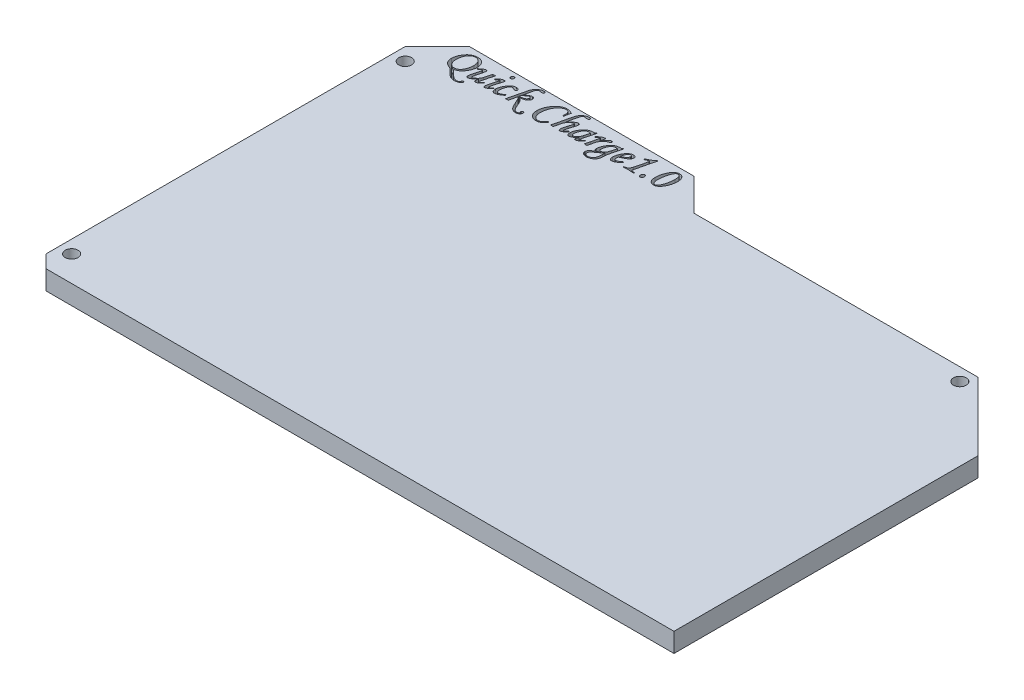
from build123d import *

# Parameters (mm, degrees)
SKETCH_1_W          = 84
SKETCH_1_H          = 50
EXTRUDE_1_DEPTH     = 3
EXTRUDE_2_DEPTH     = 3
MM_1_D              = 2
CUT_EXTRUDE_1_DEPTH = 3
CHAMFER_1_SIZE      = 2


with BuildPart() as part:
    # 草图1 → 凸台-拉伸1 (new body)
    with BuildSketch(Plane(origin=(0, 0, 0), x_dir=(1, 0, 0), z_dir=(0, 1, 0))):
        with Locations((42, -25)):
            Rectangle(SKETCH_1_W, SKETCH_1_H)
    extrude(amount=EXTRUDE_1_DEPTH)

    # 草图2 → 凸台-拉伸2 (add)
    with BuildSketch(Plane(origin=(0, 0, 0), x_dir=(1, 0, 0), z_dir=(0, 1, 0))):
        Polygon((0, 0), (0, 8), (5, 13), (40, 13), (45, 8), (89.293398282, 8), (99.9, -2.606601718), (99.9, -50), (84, -50), (84, 0), align=None)
    extrude(amount=EXTRUDE_2_DEPTH)

    # 大小mm 暗销孔1 (through all)
    with Locations(Plane(origin=(0, 3, 0), x_dir=(1, 0, 0), z_dir=(0, 1, 0))):
        with Locations((2, 6), (2, -46), (88.464971157, 6)):
            Hole(MM_1_D / 2)

    # 草图6 → 切除-拉伸1 (cut)
    # profile 1 of 15: a face of its own
    with BuildSketch(Plane(origin=(0, 3, 0), x_dir=(1, 0, 0), z_dir=(0, 1, 0))):
        with BuildLine():
            Line((6.839419264, 8.674262309), (7.535834773, 7.997476159))
            add(Edge.make_bspline(
                [(7.535834773, 7.997476159), (7.561882358, 7.972308253), (7.612400659, 7.923496055), (7.687557438, 7.855026536), (7.75713022, 7.791356279), (7.823148746, 7.735397895), (7.883762669, 7.6843467), (7.940531319, 7.640378747), (7.99284411, 7.602421546), (8.054733963, 7.561525562), (8.126249099, 7.519960686), (8.20515899, 7.478177614), (8.275294095, 7.445075959), (8.356429021, 7.414292973), (8.45344203, 7.391526608), (8.530548847, 7.388095082), (8.56850973, 7.386405688)],
                knots=[0, 0, 0, 0, 1.237840097, 2.400743827, 3.474683157, 4.460740066, 5.358314755, 6.182936652, 6.914232187, 7.566832428, 8.717436439, 9.739507216, 10.618241756, 11.365901111, 12.703192242, 14, 14, 14, 14], degree=3))
            add(Edge.make_bspline(
                [(8.56850973, 7.386405688), (8.60623919, 7.387810059), (8.679292963, 7.390529276), (8.781114886, 7.417641995), (8.866213536, 7.455815491), (8.926370486, 7.496267049), (8.964077188, 7.539835947), (8.993321647, 7.582867142), (9.025832581, 7.636564879), (9.046438446, 7.676993571), (9.057536796, 7.698768527)],
                knots=[0, 0, 0, 0, 1.453960744, 2.81523554, 4.034192944, 5.049249919, 5.578279615, 6.248625885, 7.056707214, 8, 8, 8, 8], degree=3))
            add(Edge.make_bspline(
                [(9.057536796, 7.698768527), (9.070222336, 7.721080805), (9.093685227, 7.762349096), (9.14076634, 7.810496545), (9.194425085, 7.840849823), (9.23299452, 7.844570252), (9.252123483, 7.846415442)],
                knots=[0, 0, 0, 0, 1.193874464, 2.208163522, 3.111317701, 4, 4, 4, 4], degree=3))
            add(Edge.make_bspline(
                [(9.252123483, 7.846415442), (9.269771021, 7.844166988), (9.306566223, 7.839478951), (9.351410509, 7.803302686), (9.387464522, 7.756642185), (9.391706218, 7.717871945), (9.393796245, 7.698768527)],
                knots=[0, 0, 0, 0, 0.935384244, 1.950280605, 2.99003341, 4, 4, 4, 4], degree=3))
            add(Edge.make_bspline(
                [(9.393796245, 7.698768527), (9.393071324, 7.684980464), (9.391581499, 7.656643849), (9.375609481, 7.615424486), (9.352120773, 7.574495271), (9.318898563, 7.534270621), (9.276570063, 7.494219237), (9.225204847, 7.454103099), (9.163969622, 7.41515645), (9.069914764, 7.362243771), (8.937905288, 7.304538522), (8.763219427, 7.258021027), (8.573888036, 7.226872621), (8.442049097, 7.224018201), (8.373923044, 7.222543216)],
                knots=[0, 0, 0, 0, 0.410772327, 0.844201054, 1.305563595, 1.820011342, 2.397930241, 3.046664932, 3.766746912, 4.567028023, 6.274807318, 8.059019336, 9.963549614, 12, 12, 12, 12], degree=3))
            add(Edge.make_bspline(
                [(8.373923044, 7.222543216), (8.322054293, 7.223939668), (8.218614441, 7.22672456), (8.065327344, 7.251697394), (7.914723782, 7.291347128), (7.789875968, 7.337205263), (7.686978103, 7.38819602), (7.602078319, 7.442142291), (7.508306709, 7.508722312), (7.406573363, 7.589620198), (7.29686986, 7.684341275), (7.179170246, 7.793216958), (7.052801183, 7.91526499), (6.966957967, 8.002401474), (6.922203951, 8.047829731)],
                knots=[0, 0, 0, 0, 1.081646913, 2.1570868, 3.231149768, 4.328144545, 4.925429105, 5.62384573, 6.424285178, 7.324444463, 8.334622792, 9.447861962, 10.669453067, 12, 12, 12, 12], degree=3))
            add(Edge.make_bspline(
                [(6.922203951, 8.047829731), (6.891247415, 8.079742585), (6.832138085, 8.140677938), (6.747144763, 8.226669421), (6.669758483, 8.302904428), (6.601317525, 8.370184996), (6.540133379, 8.427625106), (6.48788675, 8.47614077), (6.443302574, 8.514980522), (6.393028348, 8.555079739), (6.327467223, 8.598193274), (6.239189236, 8.647748867), (6.135111994, 8.696668848), (6.059806431, 8.727263123), (6.020106901, 8.743391789)],
                knots=[0, 0, 0, 0, 1.389392345, 2.652947053, 3.778205873, 4.784086693, 5.651955474, 6.400680924, 7.01203424, 7.499371766, 8.409209408, 9.460087758, 10.661011005, 12, 12, 12, 12], degree=3))
            add(Edge.make_bspline(
                [(6.020106901, 8.743391789), (5.986001574, 8.757055826), (5.918926471, 8.783928951), (5.824260601, 8.83317452), (5.735682202, 8.886727023), (5.654536244, 8.946738626), (5.579688163, 9.012028592), (5.511357348, 9.082550002), (5.450358223, 9.159436362), (5.395908408, 9.241123986), (5.348313613, 9.327219524), (5.307432996, 9.416390595), (5.271981661, 9.507707171), (5.244313721, 9.602408443), (5.220575387, 9.69901673), (5.20579291, 9.799036398), (5.196036635, 9.901329185), (5.194661656, 9.970630019), (5.193966935, 10.005644898)],
                knots=[0, 0, 0, 0, 1.092606212, 2.148833637, 3.170860018, 4.169734078, 5.147584489, 6.123381051, 7.087097212, 8.063737842, 9.04129511, 10.010867078, 10.980808477, 11.952926662, 12.944601536, 13.938261386, 14.958287748, 16, 16, 16, 16], degree=3))
            add(Edge.make_bspline(
                [(5.193966935, 10.005644898), (5.195683317, 10.069729188), (5.199113455, 10.197799781), (5.224552614, 10.388644846), (5.266552995, 10.577382608), (5.325810347, 10.764098336), (5.40218954, 10.948569347), (5.494816766, 11.131247101), (5.604647611, 11.311150654), (5.728178219, 11.487026572), (5.865222136, 11.651463051), (6.014674982, 11.796961133), (6.175822085, 11.918980286), (6.346297706, 12.020169042), (6.528049606, 12.096920102), (6.7192052, 12.152938684), (6.920710792, 12.186901757), (7.058624997, 12.190969981), (7.128738942, 12.193038217)],
                knots=[0, 0, 0, 0, 0.95189492, 1.902334377, 2.85494213, 3.821363528, 4.808740083, 5.818088461, 6.861136845, 7.937626777, 9.008560036, 10.036783418, 11.02917665, 12.004841909, 12.974363599, 13.952031594, 14.95883716, 16, 16, 16, 16], degree=3))
            add(Edge.make_bspline(
                [(7.128738942, 12.193038217), (7.179145796, 12.191947899), (7.277166434, 12.189827678), (7.420135689, 12.17171415), (7.554478855, 12.141059506), (7.68077379, 12.098460625), (7.79854365, 12.043270207), (7.908643927, 11.976994663), (8.008934619, 11.89631041), (8.101001139, 11.805519471), (8.182102757, 11.7044919), (8.25515618, 11.597730362), (8.314183949, 11.482484408), (8.364557942, 11.361463688), (8.40263173, 11.233227744), (8.42965906, 11.098101842), (8.447525834, 10.956582076), (8.449086339, 10.859719878), (8.449880127, 10.810448605)],
                knots=[0, 0, 0, 0, 1.121615591, 2.181081914, 3.20098345, 4.184136218, 5.141588219, 6.090691808, 7.037045654, 7.999676043, 8.962868528, 9.916460327, 10.873723875, 11.839099177, 12.830697802, 13.845239073, 14.903929349, 16, 16, 16, 16], degree=3))
            add(Edge.make_bspline(
                [(8.449880127, 10.810448605), (8.448655148, 10.754047378), (8.44619647, 10.640843466), (8.423375519, 10.471762056), (8.389900132, 10.302891619), (8.340433751, 10.134659468), (8.277185301, 9.96674637), (8.200084708, 9.799104543), (8.108938783, 9.632321893), (8.006344801, 9.467886828), (7.893297471, 9.310795384), (7.767850006, 9.169867409), (7.635474819, 9.043757037), (7.493165638, 8.936130983), (7.342593222, 8.844519448), (7.183025634, 8.770481166), (7.015147309, 8.71105993), (6.898372237, 8.686607118), (6.839419264, 8.674262309)],
                knots=[0, 0, 0, 0, 0.937888965, 1.882453719, 2.833871112, 3.799961426, 4.795963768, 5.816746267, 6.867216249, 7.955887643, 9.039826491, 10.082591367, 11.090398858, 12.076762258, 13.045122242, 14.016992042, 14.998894091, 16, 16, 16, 16], degree=3))
        make_face()
        with BuildLine():
            add(Edge.make_bspline(
                [(7.919033992, 10.77801749), (7.918143921, 10.824123945), (7.916404648, 10.914219786), (7.904926018, 11.045834911), (7.883220857, 11.170094214), (7.854263483, 11.287341558), (7.81807087, 11.398312506), (7.771380482, 11.50159759), (7.718001359, 11.59870419), (7.65545171, 11.687306453), (7.586986855, 11.76721602), (7.513038112, 11.836851499), (7.434772468, 11.896768714), (7.351000314, 11.945379919), (7.26246723, 11.983394389), (7.169201592, 12.009669021), (7.071324859, 12.026635709), (7.004207511, 12.028318175), (6.969997172, 12.029175745)],
                knots=[0, 0, 0, 0, 1.258966714, 2.460125518, 3.603060244, 4.69951734, 5.755753261, 6.784995575, 7.789945123, 8.776932282, 9.740784681, 10.658458871, 11.545542523, 12.426175068, 13.296192212, 14.168979015, 15.0667115, 16, 16, 16, 16], degree=3))
            add(Edge.make_bspline(
                [(6.969997172, 12.029175745), (6.92521718, 12.027834408), (6.836986092, 12.02519154), (6.707987542, 12.000187177), (6.585109183, 11.961142312), (6.468367983, 11.905590891), (6.358038559, 11.834380173), (6.254134292, 11.747390965), (6.157237861, 11.644330548), (6.066676548, 11.527592188), (5.985572472, 11.397943065), (5.913203419, 11.259637832), (5.853927755, 11.11178093), (5.803996684, 10.95589666), (5.765830488, 10.79086328), (5.739132126, 10.617113022), (5.721133939, 10.435023601), (5.719614522, 10.310656158), (5.718838918, 10.247171355)],
                knots=[0, 0, 0, 0, 0.886308589, 1.746315013, 2.592939, 3.434973185, 4.29951074, 5.187824069, 6.112716183, 7.096892651, 8.110123901, 9.138601926, 10.185204306, 11.261788327, 12.378717072, 13.53695789, 14.742711613, 16, 16, 16, 16], degree=3))
            add(Edge.make_bspline(
                [(5.718838918, 10.247171355), (5.719646598, 10.195657544), (5.721219974, 10.095307736), (5.733730938, 9.949211758), (5.756284318, 9.812484641), (5.785327612, 9.684550351), (5.82503405, 9.566176146), (5.872497319, 9.456487839), (5.929242599, 9.355879519), (5.993843645, 9.264573182), (6.065547892, 9.18379544), (6.141706856, 9.112784049), (6.223477825, 9.053866085), (6.309210205, 9.00430668), (6.400390791, 8.966976603), (6.49558065, 8.939385769), (6.595595737, 8.922660903), (6.663828561, 8.920935355), (6.698599952, 8.920056018)],
                knots=[0, 0, 0, 0, 1.335709599, 2.601985734, 3.797755192, 4.926814874, 5.999878964, 7.030520726, 8.021458247, 8.989618937, 9.925077071, 10.817791425, 11.683929174, 12.533030228, 13.379660301, 14.231832023, 15.098943049, 16, 16, 16, 16], degree=3))
            add(Edge.make_bspline(
                [(6.698599952, 8.920056018), (6.740517468, 8.921835226), (6.823611247, 8.925362179), (6.945737495, 8.949344287), (7.062071291, 8.991508528), (7.174273361, 9.047832148), (7.280169825, 9.12244062), (7.38190862, 9.212164318), (7.477898056, 9.318369908), (7.568154419, 9.439550396), (7.64977047, 9.573540551), (7.723275156, 9.717406534), (7.783476112, 9.871737739), (7.832520679, 10.035137588), (7.872559193, 10.207457452), (7.898592226, 10.389362804), (7.916818945, 10.580499844), (7.918283748, 10.711117567), (7.919033992, 10.77801749)],
                knots=[0, 0, 0, 0, 0.818084735, 1.621702747, 2.417243215, 3.226747497, 4.064621986, 4.93795168, 5.869443416, 6.853325843, 7.882732799, 8.928127691, 10.002493304, 11.110813623, 12.255692878, 13.451619705, 14.69476789, 16, 16, 16, 16], degree=3))
        make_face(mode=Mode.SUBTRACT)
    # profile 2 of 15: a face of its own
    with BuildSketch(Plane(origin=(0, 3, 0), x_dir=(1, 0, 0), z_dir=(0, 1, 0))):
        with BuildLine():
            Line((10.591187126, 11.07160442), (10.998282956, 11.07160442))
            Line((10.998282956, 11.07160442), (10.726885736, 10.074774379))
            add(Edge.make_bspline(
                [(10.726885736, 10.074774379), (10.717605378, 10.038332279), (10.699605764, 9.967651407), (10.671648842, 9.865271468), (10.647189421, 9.768679964), (10.624164433, 9.678210992), (10.602564013, 9.594138344), (10.584267002, 9.515931672), (10.565906542, 9.444773345), (10.55055149, 9.379266972), (10.53710518, 9.320047423), (10.524934095, 9.266895871), (10.514995649, 9.220179337), (10.505789489, 9.179963438), (10.500493607, 9.14559039), (10.494705046, 9.117630685), (10.492147844, 9.095630197), (10.491569371, 9.083068016), (10.491333431, 9.077944338)],
                knots=[0, 0, 0, 0, 1.761146463, 3.415812087, 4.970133389, 6.427497558, 7.787910004, 9.035258181, 10.18885883, 11.229441656, 12.186124951, 13.032967009, 13.782987029, 14.42319887, 14.964229763, 15.411106758, 15.759810833, 16, 16, 16, 16], degree=3))
            add(Edge.make_bspline(
                [(10.491333431, 9.077944338), (10.492088759, 9.062043467), (10.493447524, 9.033439239), (10.51238033, 8.996398131), (10.545324146, 8.97288625), (10.571711627, 8.971282196), (10.586066423, 8.97040959)],
                knots=[0, 0, 0, 0, 1.161098316, 2.088710757, 2.960258149, 4, 4, 4, 4], degree=3))
            add(Edge.make_bspline(
                [(10.586066423, 8.97040959), (10.594398984, 8.970853097), (10.612402552, 8.97181135), (10.639656814, 8.982649077), (10.669838115, 8.997022608), (10.697187473, 9.014590531), (10.723736996, 9.034577751), (10.750859036, 9.057597724), (10.783831765, 9.089008666), (10.825179703, 9.125828615), (10.871631616, 9.171897353), (10.926652774, 9.223233522), (10.987068249, 9.283463219), (11.029584051, 9.32600703), (11.05205033, 9.348488107)],
                knots=[0, 0, 0, 0, 0.49059472, 1.059992999, 1.714744262, 2.47103554, 2.975853342, 3.68039125, 4.573505113, 5.669216904, 6.95449356, 8.442255564, 10.120010186, 12, 12, 12, 12], degree=3))
            Line((11.05205033, 9.348488107), (11.145929871, 9.24180681))
            add(Edge.make_bspline(
                [(11.145929871, 9.24180681), (11.099678972, 9.194456029), (11.011928271, 9.104618552), (10.880715596, 8.982975971), (10.7595395, 8.879603362), (10.647071856, 8.794619228), (10.543566044, 8.728559831), (10.449122015, 8.680430358), (10.363237562, 8.649383821), (10.307755684, 8.644795114), (10.282238089, 8.642684645)],
                knots=[0, 0, 0, 0, 1.483507071, 2.814621667, 4.009155345, 5.052410017, 5.972380846, 6.756630627, 7.428141279, 8, 8, 8, 8], degree=3))
            add(Edge.make_bspline(
                [(10.282238089, 8.642684645), (10.266487444, 8.643405065), (10.235492637, 8.64482274), (10.191462604, 8.658973575), (10.151672859, 8.68203508), (10.116872265, 8.713541223), (10.088203103, 8.7532178), (10.068912812, 8.800364432), (10.056624709, 8.853433687), (10.055144162, 8.890963806), (10.054366838, 8.910668063)],
                knots=[0, 0, 0, 0, 0.954347206, 1.87800608, 2.776093843, 3.730441049, 4.708737558, 5.723001765, 6.804518571, 8, 8, 8, 8], degree=3))
            add(Edge.make_bspline(
                [(10.054366838, 8.910668063), (10.055057696, 8.93914565), (10.056526888, 8.99970661), (10.06848547, 9.095192824), (10.087624984, 9.200738677), (10.104408452, 9.274018075), (10.113254914, 9.312643191)],
                knots=[0, 0, 0, 0, 0.839151034, 1.784554085, 2.832252184, 4, 4, 4, 4], degree=3))
            add(Edge.make_bspline(
                [(10.113254914, 9.312643191), (10.079601024, 9.272943283), (10.009865108, 9.19067911), (9.88625974, 9.07750431), (9.746484255, 8.964900579), (9.618218482, 8.876599882), (9.512359543, 8.808536057), (9.43408698, 8.765335171), (9.360361766, 8.726990825), (9.289184988, 8.69765216), (9.222309225, 8.672791919), (9.158563502, 8.655979452), (9.098321534, 8.644832412), (9.059287482, 8.643383309), (9.040467789, 8.642684645)],
                knots=[0, 0, 0, 0, 1.447513594, 2.999465639, 4.655518334, 6.441587227, 7.331403013, 8.157514715, 8.929591463, 9.64294023, 10.299235926, 10.913935538, 11.476370037, 12, 12, 12, 12], degree=3))
            add(Edge.make_bspline(
                [(9.040467789, 8.642684645), (9.023843747, 8.64331842), (8.991956141, 8.644534104), (8.947843265, 8.658873837), (8.90931376, 8.680278592), (8.87893405, 8.712383541), (8.855365245, 8.752968541), (8.840107749, 8.802276472), (8.829421885, 8.859575396), (8.828468481, 8.900651043), (8.827958645, 8.922616369)],
                knots=[0, 0, 0, 0, 0.992537342, 1.903847458, 2.751876877, 3.607923648, 4.517317903, 5.54170635, 6.685420062, 8, 8, 8, 8], degree=3))
            add(Edge.make_bspline(
                [(8.827958645, 8.922616369), (8.829593031, 8.971668132), (8.832988129, 9.073562964), (8.854999691, 9.189404189), (8.873705615, 9.275589198), (8.888871269, 9.332480205), (8.905503207, 9.400934312), (8.926205409, 9.480252925), (8.950004352, 9.570744769), (8.977648726, 9.672140334), (9.00699781, 9.78508962), (9.028957734, 9.863722951), (9.040467789, 9.904937754)],
                knots=[0, 0, 0, 0, 1.459238376, 3.031264085, 3.499781507, 4.085229206, 4.783653742, 5.597136249, 6.525711843, 7.569404023, 8.726029637, 10, 10, 10, 10], degree=3))
            add(Edge.make_bspline(
                [(9.040467789, 9.904937754), (9.05550179, 9.960138912), (9.083937233, 10.06454688), (9.124912124, 10.212386729), (9.157751546, 10.343452989), (9.185264871, 10.456920952), (9.206921451, 10.553030108), (9.222638299, 10.631756616), (9.231756966, 10.693620371), (9.234082845, 10.729070332), (9.235054475, 10.743879475)],
                knots=[0, 0, 0, 0, 1.592371817, 3.01182635, 4.269682353, 5.3528203, 6.261453208, 7.011487114, 7.587050909, 8, 8, 8, 8], degree=3))
            add(Edge.make_bspline(
                [(9.235054475, 10.743879475), (9.234643812, 10.756189054), (9.23391349, 10.778080343), (9.223458533, 10.807075698), (9.202063355, 10.825119738), (9.185007632, 10.826698977), (9.176166399, 10.827517612)],
                knots=[0, 0, 0, 0, 1.271843986, 2.261840451, 3.098984324, 4, 4, 4, 4], degree=3))
            add(Edge.make_bspline(
                [(9.176166399, 10.827517612), (9.165251288, 10.826245073), (9.140422085, 10.823350359), (9.101090661, 10.807013944), (9.055006878, 10.783449874), (9.003607613, 10.747803561), (8.945110361, 10.703865489), (8.88038153, 10.649475693), (8.808421621, 10.586593068), (8.75976685, 10.539839017), (8.734079103, 10.515154774)],
                knots=[0, 0, 0, 0, 0.478848404, 1.089262743, 1.846388548, 2.743959643, 3.819389508, 5.048124166, 6.441529214, 8, 8, 8, 8], degree=3))
            Line((8.734079103, 10.515154774), (8.604354646, 10.615008468))
            add(Edge.make_bspline(
                [(8.604354646, 10.615008468), (8.653855989, 10.657452883), (8.74825353, 10.738393078), (8.887099988, 10.848375381), (9.015072998, 10.94216998), (9.132803096, 11.018648765), (9.240133284, 11.078398467), (9.336958309, 11.120482868), (9.422909401, 11.149182372), (9.477830836, 11.153336126), (9.503037894, 11.155242557)],
                knots=[0, 0, 0, 0, 1.47096506, 2.805085149, 3.995126474, 5.049035206, 5.971024912, 6.761513457, 7.431577078, 8, 8, 8, 8], degree=3))
            add(Edge.make_bspline(
                [(9.503037894, 11.155242557), (9.516181196, 11.154570975), (9.541407875, 11.153281969), (9.576680838, 11.144042086), (9.607084161, 11.128362414), (9.631564799, 11.105625889), (9.64968895, 11.075923652), (9.663426962, 11.04077327), (9.670708306, 10.999066481), (9.671566293, 10.96949997), (9.672021069, 10.953828268)],
                knots=[0, 0, 0, 0, 1.048360048, 2.012176323, 2.885645772, 3.753193326, 4.641294773, 5.640562065, 6.749382072, 8, 8, 8, 8], degree=3))
            add(Edge.make_bspline(
                [(9.672021069, 10.953828268), (9.671179326, 10.934172536), (9.669219725, 10.888413433), (9.65770228, 10.811357069), (9.641665998, 10.716241072), (9.618063208, 10.603354573), (9.588184598, 10.472194707), (9.551479518, 10.323101609), (9.507431652, 10.156311694), (9.476051121, 10.039203328), (9.459511924, 9.977481036)],
                knots=[0, 0, 0, 0, 0.471555149, 1.097793737, 1.866125425, 2.785365763, 3.862852174, 5.09233584, 6.467507464, 8, 8, 8, 8], degree=3))
            add(Edge.make_bspline(
                [(9.459511924, 9.977481036), (9.44535749, 9.919713918), (9.418789221, 9.811283425), (9.380479439, 9.659405875), (9.35014472, 9.527738686), (9.324572903, 9.416792318), (9.303609509, 9.326472017), (9.289431198, 9.256732263), (9.279542214, 9.207916951), (9.277585863, 9.182083464), (9.276873544, 9.172677329)],
                knots=[0, 0, 0, 0, 1.728850823, 3.245101265, 4.552916209, 5.656186915, 6.554926364, 7.247433105, 7.725985682, 8, 8, 8, 8], degree=3))
            add(Edge.make_bspline(
                [(9.276873544, 9.172677329), (9.278509843, 9.153690488), (9.281772243, 9.115835131), (9.312752322, 9.06885529), (9.35216787, 9.032634483), (9.385259758, 9.02744146), (9.400623848, 9.025030414)],
                knots=[0, 0, 0, 0, 1.068097757, 2.129539099, 3.131571725, 4, 4, 4, 4], degree=3))
            add(Edge.make_bspline(
                [(9.400623848, 9.025030414), (9.416058262, 9.025954731), (9.448818557, 9.027916637), (9.499316389, 9.041730021), (9.553486995, 9.063566888), (9.611423059, 9.093681716), (9.673272268, 9.132584874), (9.738354995, 9.180528111), (9.80776687, 9.236403293), (9.879675219, 9.298852537), (9.950153994, 9.366812933), (10.01613121, 9.437400107), (10.075062304, 9.51038332), (10.128165639, 9.584078556), (10.173811058, 9.660160973), (10.212921827, 9.737435567), (10.245851462, 9.816454393), (10.262728489, 9.87037322), (10.271143234, 9.8972567)],
                knots=[0, 0, 0, 0, 0.575822735, 1.222211804, 1.941887425, 2.753936183, 3.655463329, 4.666402909, 5.769138785, 6.980750504, 8.219781053, 9.421911037, 10.584372147, 11.718706812, 12.809466967, 13.89213501, 14.949035976, 16, 16, 16, 16], degree=3))
            Line((10.271143234, 9.8972567), (10.591187126, 11.07160442))
        make_face()
    # profile 3 of 15: a face of its own
    with BuildSketch(Plane(origin=(0, 3, 0), x_dir=(1, 0, 0), z_dir=(0, 1, 0))):
        with BuildLine():
            add(Edge.make_bspline(
                [(12.318570691, 12.114520782), (12.319778839, 12.135392103), (12.322118455, 12.17581008), (12.338646773, 12.233981924), (12.367482148, 12.285765003), (12.406163323, 12.330798673), (12.451558201, 12.368440683), (12.50266926, 12.394780096), (12.556952086, 12.412469073), (12.594663247, 12.414103248), (12.613864521, 12.414935315)],
                knots=[0, 0, 0, 0, 1.06972822, 2.071562739, 3.070419401, 4.084602518, 5.1006721, 6.072864744, 7.018766548, 8, 8, 8, 8], degree=3))
            add(Edge.make_bspline(
                [(12.613864521, 12.414935315), (12.626495461, 12.414140341), (12.651578951, 12.41256162), (12.687596138, 12.398903344), (12.720684981, 12.376659501), (12.750561144, 12.347289237), (12.775915769, 12.312667629), (12.7951425, 12.274755471), (12.806759356, 12.233828516), (12.80788198, 12.205629601), (12.808451208, 12.191331316)],
                knots=[0, 0, 0, 0, 0.926043035, 1.839007389, 2.79020909, 3.840183697, 4.90257957, 5.931306375, 6.951067139, 8, 8, 8, 8], degree=3))
            add(Edge.make_bspline(
                [(12.808451208, 12.191331316), (12.80766738, 12.171831957), (12.806113641, 12.133179432), (12.787348756, 12.077598579), (12.760184967, 12.024321805), (12.720922233, 11.977478386), (12.676938444, 11.93615361), (12.627083515, 11.906659878), (12.574264459, 11.887466713), (12.537496632, 11.885214256), (12.519131529, 11.88408918)],
                knots=[0, 0, 0, 0, 1.00348455, 1.989153063, 3.001748207, 4.078467748, 5.129595805, 6.105238255, 7.05358852, 8, 8, 8, 8], degree=3))
            add(Edge.make_bspline(
                [(12.519131529, 11.88408918), (12.504249409, 11.884893831), (12.475669294, 11.886439108), (12.435005806, 11.898787987), (12.399496521, 11.919412872), (12.370012898, 11.948394107), (12.34711404, 11.983496358), (12.33100819, 12.023581245), (12.320278355, 12.0675951), (12.319152874, 12.098522703), (12.318570691, 12.114520782)],
                knots=[0, 0, 0, 0, 1.038025951, 1.993459216, 2.937459713, 3.878947338, 4.854419689, 5.843358558, 6.884423011, 8, 8, 8, 8], degree=3))
        make_face()
    # profile 4 of 15: a face of its own
    with BuildSketch(Plane(origin=(0, 3, 0), x_dir=(1, 0, 0), z_dir=(0, 1, 0))):
        with BuildLine():
            Line((11.476215168, 10.485284011), (11.34649071, 10.585137705))
            add(Edge.make_bspline(
                [(11.34649071, 10.585137705), (11.388522166, 10.630440686), (11.46918722, 10.717384315), (11.59541208, 10.832293544), (11.716182973, 10.931217646), (11.833532119, 11.012675066), (11.94793442, 11.075623675), (12.059020836, 11.120490344), (12.166515237, 11.150343004), (12.237885015, 11.153642833), (12.27248437, 11.155242557)],
                knots=[0, 0, 0, 0, 1.328345825, 2.549307048, 3.667139254, 4.683548923, 5.617046152, 6.467908447, 7.257257312, 8, 8, 8, 8], degree=3))
            add(Edge.make_bspline(
                [(12.27248437, 11.155242557), (12.289022943, 11.155168284), (12.319429164, 11.155031731), (12.360655039, 11.147954319), (12.394171522, 11.138309913), (12.420271254, 11.123614308), (12.439039909, 11.103714582), (12.452275553, 11.079693115), (12.459890061, 11.050718511), (12.460677056, 11.029832712), (12.461096904, 11.018690497)],
                knots=[0, 0, 0, 0, 1.474907678, 2.711622723, 3.724376903, 4.578691874, 5.351638777, 6.136608638, 7.005912734, 8, 8, 8, 8], degree=3))
            add(Edge.make_bspline(
                [(12.461096904, 11.018690497), (12.460495072, 11.007279351), (12.458992772, 10.978794684), (12.447899594, 10.928940415), (12.433963514, 10.863070704), (12.412839495, 10.78181167), (12.386525441, 10.684766426), (12.353915416, 10.572146432), (12.315499694, 10.44412713), (12.287366047, 10.353825638), (12.27248437, 10.306059431)],
                knots=[0, 0, 0, 0, 0.371008323, 0.926116321, 1.655457928, 2.561740994, 3.654442822, 4.924924962, 6.373397075, 8, 8, 8, 8], degree=3))
            add(Edge.make_bspline(
                [(12.27248437, 10.306059431), (12.260287266, 10.26337668), (12.23653723, 10.180265405), (12.20130801, 10.059224958), (12.168986348, 9.944830827), (12.138760211, 9.837105539), (12.112182472, 9.735839227), (12.085578751, 9.641804584), (12.064181833, 9.553828252), (12.043166578, 9.472953), (12.025758533, 9.398510505), (12.008748885, 9.331394291), (11.996683109, 9.270510877), (11.984661124, 9.216739514), (11.977561861, 9.169283893), (11.971549716, 9.128633464), (11.96640856, 9.094857201), (11.966191685, 9.074259976), (11.966095685, 9.065142582)],
                knots=[0, 0, 0, 0, 1.664924827, 3.241919002, 4.728042597, 6.123333678, 7.438139029, 8.654677202, 9.788133673, 10.833605417, 11.788532746, 12.655478302, 13.429751974, 14.116107773, 14.721280845, 15.228290271, 15.658401467, 16, 16, 16, 16], degree=3))
            add(Edge.make_bspline(
                [(11.966095685, 9.065142582), (11.96642878, 9.051093599), (11.967008502, 9.026642674), (11.977707514, 8.99484676), (11.998254297, 8.973502072), (12.016035983, 8.971444809), (12.024983761, 8.97040959)],
                knots=[0, 0, 0, 0, 1.339744446, 2.331698552, 3.160507643, 4, 4, 4, 4], degree=3))
            add(Edge.make_bspline(
                [(12.024983761, 8.97040959), (12.036222633, 8.971567457), (12.062272416, 8.974251195), (12.102960609, 8.99402631), (12.152269451, 9.021303855), (12.208549493, 9.061003503), (12.272870805, 9.111155593), (12.345511732, 9.171404002), (12.424298665, 9.244724796), (12.479624764, 9.29696072), (12.508890125, 9.324591497)],
                knots=[0, 0, 0, 0, 0.443895448, 1.02887371, 1.7642385, 2.678504976, 3.745081634, 4.990995058, 6.408353102, 8, 8, 8, 8], degree=3))
            Line((12.508890125, 9.324591497), (12.614717972, 9.212789497))
            add(Edge.make_bspline(
                [(12.614717972, 9.212789497), (12.584367343, 9.184243913), (12.525996971, 9.129345006), (12.440508011, 9.051833475), (12.361610423, 8.981207036), (12.286781551, 8.920542706), (12.220002245, 8.864917271), (12.157517483, 8.819458882), (12.102000113, 8.78018625), (12.037048332, 8.740618679), (11.962820156, 8.703277658), (11.880308449, 8.668520283), (11.804386063, 8.64771804), (11.755678057, 8.644278665), (11.733103731, 8.642684645)],
                knots=[0, 0, 0, 0, 1.402449025, 2.697191915, 3.884498493, 4.965906897, 5.939507465, 6.809026093, 7.566074359, 8.227926809, 9.36710712, 10.359366098, 11.239628018, 12, 12, 12, 12], degree=3))
            add(Edge.make_bspline(
                [(11.733103731, 8.642684645), (11.716775588, 8.643650564), (11.685402404, 8.645506497), (11.641694169, 8.660105839), (11.605078846, 8.684962338), (11.577149783, 8.719012436), (11.556580612, 8.758108804), (11.541112826, 8.799134505), (11.531206257, 8.841647133), (11.529825734, 8.870503166), (11.529129091, 8.885064552)],
                knots=[0, 0, 0, 0, 1.102587542, 2.118531266, 3.073642286, 4.056443418, 5.063606764, 6.049791042, 7.015881818, 8, 8, 8, 8], degree=3))
            add(Edge.make_bspline(
                [(11.529129091, 8.885064552), (11.529518853, 8.900152729), (11.530373681, 8.93324425), (11.53599405, 8.987047996), (11.544616972, 9.049649954), (11.556823757, 9.120699628), (11.571082115, 9.200809154), (11.590154295, 9.289191406), (11.612632616, 9.386353115), (11.636811932, 9.492463876), (11.666737932, 9.606748067), (11.697470961, 9.730582338), (11.73403567, 9.862530318), (11.772120586, 10.003512676), (11.813790186, 10.152998598), (11.860385945, 10.310576992), (11.908810688, 10.477432549), (11.942702199, 10.591415656), (11.960121532, 10.649999934)],
                knots=[0, 0, 0, 0, 0.397986951, 0.872868425, 1.425764984, 2.06478265, 2.774203817, 3.571873688, 4.449278459, 5.404863241, 6.442241245, 7.565163797, 8.770203116, 10.053558397, 11.417236777, 12.86337819, 14.38786, 16, 16, 16, 16], degree=3))
            add(Edge.make_bspline(
                [(11.960121532, 10.649999934), (11.966672791, 10.671169242), (11.978071034, 10.708000776), (11.98164493, 10.74634844), (11.983164692, 10.762655384)],
                knots=[0, 0, 0, 0, 1.14952087, 2, 2, 2, 2], degree=3))
            add(Edge.make_bspline(
                [(11.983164692, 10.762655384), (11.982549876, 10.772216132), (11.981413724, 10.78988398), (11.967498684, 10.813392826), (11.942582173, 10.825473936), (11.924103889, 10.826796796), (11.914035211, 10.827517612)],
                knots=[0, 0, 0, 0, 1.054857707, 1.949331339, 2.882606113, 4, 4, 4, 4], degree=3))
            add(Edge.make_bspline(
                [(11.914035211, 10.827517612), (11.904524298, 10.826241828), (11.881683016, 10.823177921), (11.845622033, 10.804857421), (11.801804979, 10.778417667), (11.751492976, 10.739625999), (11.692995104, 10.691444411), (11.627419735, 10.631985535), (11.553720016, 10.562858806), (11.503089421, 10.512182518), (11.476215168, 10.485284011)],
                knots=[0, 0, 0, 0, 0.407477552, 0.978592548, 1.703653279, 2.597795999, 3.685081721, 4.941158768, 6.376395254, 8, 8, 8, 8], degree=3))
        make_face()
    # profile 5 of 15: a face of its own
    with BuildSketch(Plane(origin=(0, 3, 0), x_dir=(1, 0, 0), z_dir=(0, 1, 0))):
        with BuildLine():
            Line((14.34892914, 9.365557115), (14.407817216, 9.199987742))
            add(Edge.make_bspline(
                [(14.407817216, 9.199987742), (14.352152305, 9.155968361), (14.245095268, 9.071308483), (14.084477038, 8.956990184), (13.929676172, 8.860924284), (13.781611314, 8.782032392), (13.639899934, 8.720304662), (13.504769676, 8.676609614), (13.376064423, 8.647899183), (13.291922718, 8.64437988), (13.251391954, 8.642684645)],
                knots=[0, 0, 0, 0, 1.303747359, 2.507420352, 3.619942039, 4.64870478, 5.58758023, 6.455369782, 7.255957048, 8, 8, 8, 8], degree=3))
            add(Edge.make_bspline(
                [(13.251391954, 8.642684645), (13.215839112, 8.64435966), (13.147436193, 8.647582353), (13.051943176, 8.680518537), (12.969280039, 8.733437633), (12.901338097, 8.807812452), (12.848297408, 8.900939451), (12.811327428, 9.011061747), (12.789317352, 9.137668417), (12.786762285, 9.227486136), (12.785408047, 9.275091375)],
                knots=[0, 0, 0, 0, 0.958287005, 1.843724032, 2.695058187, 3.587683185, 4.538936284, 5.572812925, 6.71354093, 8, 8, 8, 8], degree=3))
            add(Edge.make_bspline(
                [(12.785408047, 9.275091375), (12.786779912, 9.326646232), (12.789533325, 9.430119826), (12.810205093, 9.585342317), (12.842262497, 9.741023179), (12.889100817, 9.896870872), (12.948287975, 10.053339954), (13.019908982, 10.210721622), (13.106157372, 10.36781704), (13.202261979, 10.523229009), (13.306969765, 10.66986015), (13.420481902, 10.798760964), (13.538037285, 10.909505033), (13.662778853, 10.998971565), (13.792610094, 11.069086394), (13.927780159, 11.119266966), (14.068835857, 11.1491065), (14.164727589, 11.153181423), (14.21323053, 11.155242557)],
                knots=[0, 0, 0, 0, 0.959415969, 1.925603599, 2.910162499, 3.915465471, 4.951132845, 6.022232627, 7.131200806, 8.284714312, 9.422341175, 10.480428712, 11.477159546, 12.42208582, 13.329482932, 14.215790354, 15.097529968, 16, 16, 16, 16], degree=3))
            add(Edge.make_bspline(
                [(14.21323053, 11.155242557), (14.244883047, 11.154424446), (14.305239493, 11.152864433), (14.390554051, 11.136737072), (14.465586304, 11.109478905), (14.529062464, 11.071128391), (14.580233456, 11.024168204), (14.617515239, 10.969405214), (14.640963889, 10.907558886), (14.643123531, 10.863567927), (14.644222971, 10.841172818)],
                knots=[0, 0, 0, 0, 1.27059752, 2.422832553, 3.471668409, 4.461613401, 5.383565823, 6.239529789, 7.103772203, 8, 8, 8, 8], degree=3))
            add(Edge.make_bspline(
                [(14.644222971, 10.841172818), (14.643569843, 10.826902396), (14.642297706, 10.79910702), (14.632368109, 10.759228481), (14.613385136, 10.724280089), (14.589246111, 10.693249671), (14.557593399, 10.669545801), (14.522158178, 10.65075205), (14.481170336, 10.640763732), (14.452527902, 10.639539411), (14.437687979, 10.638905079)],
                knots=[0, 0, 0, 0, 1.052013956, 2.049071909, 2.996590381, 3.966136436, 4.922664795, 5.888802146, 6.906167974, 8, 8, 8, 8], degree=3))
            add(Edge.make_bspline(
                [(14.437687979, 10.638905079), (14.417121634, 10.640296291), (14.374007338, 10.643212762), (14.307506434, 10.660353913), (14.237462237, 10.689164351), (14.190812179, 10.714399278), (14.166290759, 10.727663918)],
                knots=[0, 0, 0, 0, 0.856115998, 1.794720359, 2.84080339, 4, 4, 4, 4], degree=3))
            add(Edge.make_bspline(
                [(14.166290759, 10.727663918), (14.139211869, 10.742650583), (14.088811655, 10.770544308), (14.01535542, 10.802435477), (13.949812688, 10.823438031), (13.908101368, 10.826232505), (13.888919386, 10.827517612)],
                knots=[0, 0, 0, 0, 1.246584255, 2.320187907, 3.227496839, 4, 4, 4, 4], degree=3))
            add(Edge.make_bspline(
                [(13.888919386, 10.827517612), (13.865093983, 10.82576148), (13.815579746, 10.822111866), (13.742428219, 10.794329154), (13.668629075, 10.751528808), (13.609030043, 10.702273165), (13.561449887, 10.654077914), (13.52608957, 10.609707115), (13.491999818, 10.558224822), (13.459297605, 10.499434933), (13.426428716, 10.434114971), (13.39529813, 10.361563953), (13.364371361, 10.282295747), (13.326499662, 10.167916798), (13.283871733, 10.021396602), (13.250191562, 9.84355152), (13.225850548, 9.668062803), (13.22352669, 9.55140673), (13.222374641, 9.493574672)],
                knots=[0, 0, 0, 0, 0.709978349, 1.47548553, 2.308707117, 3.250422169, 3.772903198, 4.328629454, 4.941035199, 5.614145987, 6.335762035, 7.123052985, 7.969968284, 8.875011667, 10.719320692, 12.519759133, 14.27467624, 16, 16, 16, 16], degree=3))
            add(Edge.make_bspline(
                [(13.222374641, 9.493574672), (13.223349119, 9.453096924), (13.225185621, 9.376812582), (13.243077092, 9.270325649), (13.271294909, 9.178721455), (13.312341862, 9.103212239), (13.362842143, 9.044828519), (13.418853343, 9.001732636), (13.481111159, 8.975478175), (13.524831294, 8.972098831), (13.546685785, 8.97040959)],
                knots=[0, 0, 0, 0, 1.419868418, 2.675883252, 3.778118215, 4.770450862, 5.669553394, 6.468509092, 7.234449922, 8, 8, 8, 8], degree=3))
            add(Edge.make_bspline(
                [(13.546685785, 8.97040959), (13.575515314, 8.971569901), (13.635172424, 8.97397094), (13.725859213, 8.994272565), (13.82056599, 9.025160322), (13.918735834, 9.069525983), (14.021253247, 9.125386628), (14.128061874, 9.192968472), (14.238428776, 9.273673186), (14.311138994, 9.334133625), (14.34892914, 9.365557115)],
                knots=[0, 0, 0, 0, 0.75855538, 1.569682956, 2.436870297, 3.379434498, 4.401958476, 5.509882634, 6.705795405, 8, 8, 8, 8], degree=3))
        make_face()
    # profile 6 of 15: a face of its own
    with BuildSketch(Plane(origin=(0, 3, 0), x_dir=(1, 0, 0), z_dir=(0, 1, 0))):
        with BuildLine():
            Line((15.293698708, 8.7672884), (14.862706267, 8.7672884))
            Line((14.862706267, 8.7672884), (15.240784785, 10.32654224))
            add(Edge.make_bspline(
                [(15.240784785, 10.32654224), (15.259445574, 10.40565631), (15.295309024, 10.557702589), (15.348589512, 10.775391662), (15.395949529, 10.974205595), (15.440635611, 11.152646869), (15.479709731, 11.311789605), (15.5146659, 11.45091191), (15.545462554, 11.570381756), (15.579687117, 11.70210425), (15.624268552, 11.848124944), (15.692163947, 12.007915142), (15.77203901, 12.153574998), (15.865121509, 12.284478295), (15.969416472, 12.401285782), (16.085669117, 12.503089188), (16.211424905, 12.59234627), (16.347417476, 12.662830981), (16.484339015, 12.72079818), (16.618807038, 12.7617921), (16.748067068, 12.788468595), (16.83292012, 12.792097884), (16.874288808, 12.793867283)],
                knots=[0, 0, 0, 0, 1.508869317, 2.899837759, 4.160170213, 5.30263182, 6.314453898, 7.202037674, 7.965401734, 8.6045755, 9.72859332, 10.795747191, 11.821583487, 12.806251848, 13.771065178, 14.721404688, 15.669276084, 16.626034952, 17.558706443, 18.425675675, 19.232464471, 20, 20, 20, 20], degree=3))
            add(Edge.make_bspline(
                [(16.874288808, 12.793867283), (16.895659936, 12.793258521), (16.936118854, 12.792106039), (16.993063178, 12.782385822), (17.041894843, 12.764256925), (17.082804688, 12.739566957), (17.114755195, 12.708304869), (17.139091791, 12.67235589), (17.152945138, 12.630397399), (17.154352445, 12.600800132), (17.155073983, 12.585625391)],
                knots=[0, 0, 0, 0, 1.301193064, 2.46336383, 3.499515091, 4.456298442, 5.350658296, 6.20115417, 7.077718255, 8, 8, 8, 8], degree=3))
            add(Edge.make_bspline(
                [(17.155073983, 12.585625391), (17.154527607, 12.571796616), (17.153478728, 12.545249452), (17.137622809, 12.508870198), (17.113823273, 12.477802253), (17.080189213, 12.452677118), (17.037121658, 12.434288606), (16.985324378, 12.42104672), (16.924352039, 12.412479738), (16.880579773, 12.411854947), (16.857219801, 12.411521514)],
                knots=[0, 0, 0, 0, 0.849989539, 1.631728846, 2.410287105, 3.252209262, 4.19823237, 5.291930197, 6.554782726, 8, 8, 8, 8], degree=3))
            add(Edge.make_bspline(
                [(16.857219801, 12.411521514), (16.834442244, 12.412063933), (16.786496371, 12.413205703), (16.711300882, 12.421524103), (16.629530923, 12.434154269), (16.573250334, 12.446218054), (16.544003512, 12.452487132)],
                knots=[0, 0, 0, 0, 0.863607719, 1.817860761, 2.86602751, 4, 4, 4, 4], degree=3))
            add(Edge.make_bspline(
                [(16.544003512, 12.452487132), (16.521634861, 12.457821142), (16.478960296, 12.467997285), (16.435133322, 12.469631824), (16.414279054, 12.47040959)],
                knots=[0, 0, 0, 0, 1.048336449, 2, 2, 2, 2], degree=3))
            add(Edge.make_bspline(
                [(16.414279054, 12.47040959), (16.39339164, 12.469257022), (16.352589042, 12.467005533), (16.293941234, 12.449372556), (16.240727891, 12.419609506), (16.192670011, 12.377091018), (16.149150724, 12.320794698), (16.111586587, 12.247950047), (16.07484238, 12.160569024), (16.043523831, 12.055987927), (16.012255248, 11.935886821), (15.97924481, 11.799176003), (15.943263049, 11.645930578), (15.919690921, 11.537908268), (15.90732953, 11.481260602)],
                knots=[0, 0, 0, 0, 0.629350326, 1.229406739, 1.828726283, 2.455202982, 3.152186304, 3.962435068, 4.920304306, 6.008714486, 7.251427718, 8.664729518, 10.250960467, 12, 12, 12, 12], degree=3))
            Line((15.90732953, 11.481260602), (15.706768691, 10.553560041))
            add(Edge.make_bspline(
                [(15.706768691, 10.553560041), (15.750886804, 10.601035789), (15.835430017, 10.692013212), (15.965781378, 10.814471874), (16.091475288, 10.919501133), (16.214839829, 11.004737837), (16.334485779, 11.071329367), (16.450587839, 11.119132259), (16.563241376, 11.149322996), (16.637716571, 11.153313168), (16.673727969, 11.155242557)],
                knots=[0, 0, 0, 0, 1.329855033, 2.54839133, 3.668299779, 4.688634386, 5.621558533, 6.472714013, 7.261503052, 8, 8, 8, 8], degree=3))
            add(Edge.make_bspline(
                [(16.673727969, 11.155242557), (16.70171266, 11.154258587), (16.755257782, 11.152375886), (16.830702705, 11.133730696), (16.895718195, 11.101305916), (16.950298882, 11.057353453), (16.992923087, 11.002989353), (17.024812319, 10.940908191), (17.042607085, 10.870592805), (17.044734305, 10.821355356), (17.045832334, 10.795939948)],
                knots=[0, 0, 0, 0, 1.147832938, 2.19623141, 3.162803513, 4.109760417, 5.049410389, 5.979424169, 6.957018295, 8, 8, 8, 8], degree=3))
            add(Edge.make_bspline(
                [(17.045832334, 10.795939948), (17.044696703, 10.772839034), (17.042420374, 10.726534134), (17.028541348, 10.657445259), (17.004302295, 10.589833587), (16.970413898, 10.523540057), (16.927523958, 10.458554201), (16.874803937, 10.394831238), (16.811991555, 10.333217935), (16.74157028, 10.270916148), (16.65927133, 10.213503048), (16.564588069, 10.163276962), (16.458373857, 10.120076955), (16.340465892, 10.083377721), (16.210668577, 10.053610085), (16.068787676, 10.032407852), (15.915345624, 10.0155892), (15.808943051, 10.01072849), (15.753708462, 10.00820525)],
                knots=[0, 0, 0, 0, 0.666162276, 1.335296819, 2.022729157, 2.730650376, 3.476784727, 4.263341159, 5.110070582, 6.011256494, 6.971422473, 7.995197325, 9.094874986, 10.272562474, 11.551852232, 12.929942343, 14.406303813, 16, 16, 16, 16], degree=3))
            add(Edge.make_bspline(
                [(15.753708462, 10.00820525), (15.802527505, 9.988047709), (15.899073548, 9.948183536), (16.030475372, 9.862875684), (16.150859279, 9.76296908), (16.238652144, 9.662313873), (16.304761253, 9.570728116), (16.35737575, 9.491155888), (16.409448607, 9.399190896), (16.46534765, 9.297253471), (16.520926664, 9.183447), (16.579656262, 9.05954147), (16.637857237, 8.923531516), (16.677223063, 8.829053707), (16.69762458, 8.780090156)],
                knots=[0, 0, 0, 0, 1.186733956, 2.346921638, 3.510498179, 4.699183248, 5.340957521, 6.053247845, 6.845235731, 7.719253648, 8.670137005, 9.69580644, 10.805841294, 12, 12, 12, 12], degree=3))
            add(Edge.make_bspline(
                [(16.69762458, 8.780090156), (16.714446344, 8.739586076), (16.747090401, 8.66098448), (16.798581009, 8.548539445), (16.84862443, 8.444080641), (16.898963899, 8.348401951), (16.948987795, 8.261503274), (16.998937658, 8.183469245), (17.047183092, 8.113167621), (17.095813608, 8.051221271), (17.145866014, 7.997297462), (17.198098103, 7.951311847), (17.251833413, 7.911184994), (17.309070707, 7.879901529), (17.367448455, 7.853401856), (17.428982866, 7.837196579), (17.491699596, 7.824925642), (17.534511133, 7.823894544), (17.55619566, 7.823372282)],
                knots=[0, 0, 0, 0, 1.543489961, 2.995272977, 4.352146924, 5.619632589, 6.799455918, 7.879928583, 8.879829454, 9.799294211, 10.649357824, 11.465056854, 12.246098747, 13.003684472, 13.757023756, 14.495579704, 15.237994135, 16, 16, 16, 16], degree=3))
            add(Edge.make_bspline(
                [(17.55619566, 7.823372282), (17.577872164, 7.823879482), (17.619267387, 7.824848072), (17.678514193, 7.83627936), (17.731587521, 7.854779546), (17.778067263, 7.880463112), (17.81647971, 7.911338524), (17.844888552, 7.947018138), (17.86261333, 7.987140141), (17.864292378, 8.015507445), (17.865144697, 8.029907273)],
                knots=[0, 0, 0, 0, 1.262184969, 2.410371483, 3.501440827, 4.525943062, 5.492137752, 6.354703805, 7.164813719, 8, 8, 8, 8], degree=3))
            add(Edge.make_bspline(
                [(17.865144697, 8.029907273), (17.864006439, 8.045765064), (17.861640324, 8.078728924), (17.848214963, 8.108954951), (17.841248086, 8.124640265)],
                knots=[0, 0, 0, 0, 0.962131913, 2, 2, 2, 2], degree=3))
            add(Edge.make_bspline(
                [(17.841248086, 8.124640265), (17.830937587, 8.143835742), (17.811123915, 8.18072366), (17.807834374, 8.222418464), (17.806256621, 8.242416418)],
                knots=[0, 0, 0, 0, 1.040745982, 2, 2, 2, 2], degree=3))
            add(Edge.make_bspline(
                [(17.806256621, 8.242416418), (17.806840408, 8.254740929), (17.807975793, 8.278710385), (17.81891926, 8.312510834), (17.835107943, 8.343679422), (17.859578498, 8.36934842), (17.886869999, 8.391539693), (17.917493281, 8.407068249), (17.9495944, 8.417001324), (17.971754682, 8.41838396), (17.982920849, 8.419080646)],
                knots=[0, 0, 0, 0, 1.063809596, 2.06896128, 3.049977249, 4.078993423, 5.113889738, 6.083395053, 7.034257333, 8, 8, 8, 8], degree=3))
            add(Edge.make_bspline(
                [(17.982920849, 8.419080646), (17.996964543, 8.41830485), (18.024532922, 8.41678193), (18.063993759, 8.403314633), (18.099813422, 8.381150008), (18.131898849, 8.351276152), (18.159759512, 8.314458248), (18.17945445, 8.270143826), (18.190249751, 8.219598015), (18.191969878, 8.184148708), (18.192869642, 8.165605884)],
                knots=[0, 0, 0, 0, 0.915191862, 1.796561348, 2.688831577, 3.648764834, 4.64470802, 5.684242551, 6.788673505, 8, 8, 8, 8], degree=3))
            add(Edge.make_bspline(
                [(18.192869642, 8.165605884), (18.190857833, 8.134528864), (18.186778539, 8.071514795), (18.148319457, 7.980838829), (18.089926643, 7.893940029), (18.008861504, 7.814287751), (17.909857643, 7.744833977), (17.792523501, 7.694985269), (17.660395407, 7.664941903), (17.567172998, 7.661369506), (17.518643844, 7.659509809)],
                knots=[0, 0, 0, 0, 0.797664043, 1.617402799, 2.500059433, 3.485229451, 4.528711776, 5.599407784, 6.750314308, 8, 8, 8, 8], degree=3))
            add(Edge.make_bspline(
                [(17.518643844, 7.659509809), (17.489022161, 7.660094585), (17.430135076, 7.661257104), (17.342733475, 7.672798787), (17.257024627, 7.691487009), (17.173231304, 7.718269024), (17.091092726, 7.751703438), (17.009993474, 7.791934185), (16.931322217, 7.840782461), (16.852294762, 7.896994643), (16.773741962, 7.967184659), (16.694676123, 8.054753354), (16.614860772, 8.161141778), (16.534288509, 8.285856975), (16.4500332, 8.427629301), (16.366631412, 8.589282378), (16.280193704, 8.768492771), (16.224685994, 8.895117137), (16.195795758, 8.961021636)],
                knots=[0, 0, 0, 0, 0.717658156, 1.426684572, 2.132720507, 2.841478631, 3.555982815, 4.280662621, 5.032805385, 5.798325776, 6.628649221, 7.580447649, 8.653395544, 9.848719263, 11.177952378, 12.649160002, 14.255979944, 16, 16, 16, 16], degree=3))
            add(Edge.make_bspline(
                [(16.195795758, 8.961021636), (16.178189465, 9.001716348), (16.14429645, 9.080055752), (16.095032211, 9.192535485), (16.048855516, 9.294910403), (16.006580637, 9.387420605), (15.966088528, 9.46890078), (15.930508219, 9.541307881), (15.897321402, 9.60325767), (15.857805806, 9.672936495), (15.805565486, 9.751005753), (15.736946778, 9.838960757), (15.658291682, 9.921755727), (15.600507167, 9.972243784), (15.571070081, 9.997963845)],
                knots=[0, 0, 0, 0, 1.304626295, 2.511472437, 3.612933986, 4.609115575, 5.503807787, 6.289911495, 6.982684311, 7.571355266, 8.646225114, 9.743033343, 10.850236583, 12, 12, 12, 12], degree=3))
            Line((15.571070081, 9.997963845), (15.293698708, 8.7672884))
        make_face()
        with BuildLine():
            add(Edge.make_bspline(
                [(15.589845989, 10.172067722), (15.637362653, 10.17259514), (15.728464984, 10.173606344), (15.859750866, 10.180251231), (15.980273388, 10.191923656), (16.089960632, 10.208830457), (16.189035602, 10.229881275), (16.277147781, 10.255938178), (16.354402047, 10.28734272), (16.420906387, 10.323466157), (16.478122989, 10.363373032), (16.527128774, 10.405593539), (16.569411228, 10.449848269), (16.603352093, 10.496714808), (16.630840886, 10.546074334), (16.648790928, 10.598186481), (16.662187958, 10.652176456), (16.663048036, 10.689171745), (16.663486565, 10.708034559)],
                knots=[0, 0, 0, 0, 1.716155034, 3.290334644, 4.746193904, 6.087467952, 7.296658853, 8.401848131, 9.401668642, 10.302861725, 11.129449995, 11.916254729, 12.635851969, 13.334608455, 14.001278638, 14.667552818, 15.32062422, 16, 16, 16, 16], degree=3))
            add(Edge.make_bspline(
                [(16.663486565, 10.708034559), (16.662718875, 10.725750543), (16.66127462, 10.75907959), (16.649155897, 10.805990685), (16.628552592, 10.846124721), (16.599865672, 10.87843277), (16.567430444, 10.903931746), (16.533485842, 10.922807244), (16.498438727, 10.934959905), (16.474681131, 10.936163644), (16.462925726, 10.936759261)],
                knots=[0, 0, 0, 0, 1.254841086, 2.360730252, 3.407441504, 4.4227709, 5.3994866, 6.320441202, 7.168944006, 8, 8, 8, 8], degree=3))
            add(Edge.make_bspline(
                [(16.462925726, 10.936759261), (16.439422284, 10.934515401), (16.388070045, 10.929612834), (16.307701272, 10.900675354), (16.219103044, 10.854035065), (16.119588226, 10.791185149), (16.010936846, 10.709476766), (15.892417779, 10.6100627), (15.764356671, 10.492666058), (15.677456718, 10.406787267), (15.631665058, 10.361533706)],
                knots=[0, 0, 0, 0, 0.549532246, 1.20066291, 1.975971705, 2.886329373, 3.945095994, 5.147612526, 6.496943307, 8, 8, 8, 8], degree=3))
            Line((15.631665058, 10.361533706), (15.589845989, 10.172067722))
        make_face(mode=Mode.SUBTRACT)
    # profile 7 of 15: a face of its own
    with BuildSketch(Plane(origin=(0, 3, 0), x_dir=(1, 0, 0), z_dir=(0, 1, 0))):
        with BuildLine():
            Line((21.797844039, 10.933345459), (21.633981566, 10.933345459))
            add(Edge.make_bspline(
                [(21.633981566, 10.933345459), (21.634823367, 10.956388986), (21.636423949, 11.000203423), (21.638868798, 11.062226971), (21.641706512, 11.117391869), (21.643456417, 11.165758629), (21.64415682, 11.207589119), (21.644866389, 11.242299302), (21.64610764, 11.270166562), (21.645984059, 11.286388558), (21.645929871, 11.293501519)],
                knots=[0, 0, 0, 0, 1.535649812, 2.919849639, 4.133702613, 5.214269209, 6.142799353, 6.919802006, 7.526358754, 8, 8, 8, 8], degree=3))
            add(Edge.make_bspline(
                [(21.645929871, 11.293501519), (21.645409987, 11.323103338), (21.644398787, 11.380680328), (21.63742272, 11.464154525), (21.626906539, 11.542154218), (21.6102494, 11.614181978), (21.590586437, 11.680834554), (21.564343984, 11.741137828), (21.534588905, 11.796329577), (21.499893138, 11.845869389), (21.459833394, 11.888947229), (21.416224976, 11.927137654), (21.367208181, 11.958701953), (21.313716367, 11.984238125), (21.25608837, 12.005128715), (21.193598605, 12.019259676), (21.126431486, 12.028047372), (21.080121407, 12.028791366), (21.05619566, 12.029175745)],
                knots=[0, 0, 0, 0, 1.317941581, 2.563461074, 3.727883503, 4.818812153, 5.852571197, 6.817279918, 7.741294526, 8.641025752, 9.501653031, 10.354883975, 11.215697678, 12.088175805, 12.989688678, 13.939140813, 14.935272942, 16, 16, 16, 16], degree=3))
            add(Edge.make_bspline(
                [(21.05619566, 12.029175745), (21.024575245, 12.028042606), (20.961335693, 12.025776374), (20.866856758, 12.011992962), (20.773053343, 11.987855425), (20.680093731, 11.952990959), (20.58636397, 11.910466996), (20.493553775, 11.857173512), (20.401224664, 11.794597282), (20.309835892, 11.722865714), (20.22090817, 11.641862356), (20.133647002, 11.553074563), (20.052615144, 11.453526685), (19.973458474, 11.346311337), (19.898025352, 11.230595694), (19.825476418, 11.106200583), (19.759253414, 10.971971038), (19.694241073, 10.83161633), (19.635936595, 10.686400659), (19.585626693, 10.538651815), (19.541642172, 10.390532685), (19.506875023, 10.240825556), (19.479594511, 10.090719165), (19.459540804, 9.939812511), (19.448665758, 9.787891908), (19.446712868, 9.686185413), (19.445734797, 9.635247434)],
                knots=[0, 0, 0, 0, 0.723867297, 1.447705304, 2.180538325, 2.936610903, 3.717513696, 4.534091856, 5.382954578, 6.26877763, 7.190838563, 8.134872909, 9.115372348, 10.126048036, 11.184434267, 12.275645223, 13.420133602, 14.609000184, 15.815797105, 16.999892512, 18.180616873, 19.351043053, 20.51591295, 21.671738193, 22.83392945, 24, 24, 24, 24], degree=3))
            add(Edge.make_bspline(
                [(19.445734797, 9.635247434), (19.44629486, 9.587147997), (19.447386758, 9.493373359), (19.458624459, 9.356543276), (19.477210678, 9.227998141), (19.502710579, 9.107253154), (19.535868985, 8.994838675), (19.5759376, 8.889873212), (19.623570265, 8.793045659), (19.679111989, 8.70518298), (19.740456298, 8.626425685), (19.806941172, 8.557739536), (19.878804149, 8.49988535), (19.954679038, 8.451726857), (20.035848868, 8.414326607), (20.122228403, 8.389320939), (20.212873988, 8.372096678), (20.275205793, 8.370428067), (20.306866228, 8.369580524)],
                knots=[0, 0, 0, 0, 1.346563369, 2.625259236, 3.840763817, 4.981264131, 6.077655944, 7.119080047, 8.123661869, 9.093831367, 10.024409805, 10.914420773, 11.764093041, 12.601693937, 13.425084229, 14.256717255, 15.114527655, 16, 16, 16, 16], degree=3))
            add(Edge.make_bspline(
                [(20.306866228, 8.369580524), (20.348274642, 8.371396935), (20.431473518, 8.375046515), (20.554600054, 8.404661397), (20.675209281, 8.452085675), (20.792854732, 8.518921361), (20.908072106, 8.604275161), (21.019340883, 8.709787327), (21.130328193, 8.831898965), (21.197838062, 8.92366035), (21.232859888, 8.97126304)],
                knots=[0, 0, 0, 0, 0.864573051, 1.737122937, 2.631420144, 3.565789256, 4.556333419, 5.620642378, 6.765670088, 8, 8, 8, 8], degree=3))
            add(Edge.make_bspline(
                [(21.232859888, 8.97126304), (21.239645277, 8.980105034), (21.252482267, 8.996832826), (21.275656873, 9.015869139), (21.300819283, 9.028521906), (21.31863143, 9.0296058), (21.32759288, 9.030151116)],
                knots=[0, 0, 0, 0, 1.14850621, 2.172810111, 3.080724453, 4, 4, 4, 4], degree=3))
            add(Edge.make_bspline(
                [(21.32759288, 9.030151116), (21.336026014, 9.028938804), (21.354914392, 9.026223489), (21.380163586, 9.01032385), (21.404382541, 8.989296065), (21.407880183, 8.968900769), (21.409524117, 8.959314735)],
                knots=[0, 0, 0, 0, 0.86430598, 1.935856538, 3.029827724, 4, 4, 4, 4], degree=3))
            add(Edge.make_bspline(
                [(21.409524117, 8.959314735), (21.408679413, 8.951567617), (21.40678751, 8.93421622), (21.396146299, 8.906608393), (21.380771439, 8.87394271), (21.358265674, 8.83684535), (21.32999705, 8.795047784), (21.295532145, 8.748634379), (21.254323659, 8.697823117), (21.192650113, 8.622675171), (21.10524537, 8.531817683), (20.988749739, 8.433449588), (20.860288593, 8.350002655), (20.724211061, 8.278459117), (20.582238783, 8.222938439), (20.4393576, 8.181051636), (20.29603808, 8.156619461), (20.200555459, 8.152926859), (20.15324516, 8.151097227)],
                knots=[0, 0, 0, 0, 0.236240202, 0.52911258, 0.893041694, 1.335387848, 1.846702672, 2.428340489, 3.093382138, 3.836971679, 5.385667005, 6.921612453, 8.465171934, 10.036913873, 11.591113715, 13.095047803, 14.560636939, 16, 16, 16, 16], degree=3))
            add(Edge.make_bspline(
                [(20.15324516, 8.151097227), (20.1021437, 8.153250335), (19.999157495, 8.157589555), (19.845537574, 8.192893542), (19.692847741, 8.248930837), (19.568462128, 8.312677744), (19.472417821, 8.374732521), (19.403600853, 8.426537767), (19.338685868, 8.483188771), (19.279445136, 8.546002176), (19.22285878, 8.612116225), (19.171148701, 8.683721987), (19.124646824, 8.760489772), (19.067118171, 8.869501195), (19.007625703, 9.01643928), (18.957768823, 9.206001003), (18.926302413, 9.408889762), (18.922706629, 9.548930117), (18.920862814, 9.620738778)],
                knots=[0, 0, 0, 0, 1.143431762, 2.304390091, 3.511693828, 4.779688155, 5.424713563, 6.070745055, 6.707250198, 7.35161451, 8.002590751, 8.655092879, 9.327086111, 10.011053439, 11.414216502, 12.865389065, 14.392661786, 16, 16, 16, 16], degree=3))
            add(Edge.make_bspline(
                [(18.920862814, 9.620738778), (18.921825778, 9.673976787), (18.923750535, 9.780388129), (18.940020296, 9.939371521), (18.964388461, 10.097639715), (18.999604418, 10.254974645), (19.045080909, 10.411683361), (19.100604886, 10.567463843), (19.165578272, 10.722596905), (19.240558207, 10.874993932), (19.322313569, 11.023463439), (19.411580075, 11.164169667), (19.504601242, 11.297722674), (19.602208585, 11.423673239), (19.707153593, 11.539455175), (19.815553143, 11.648757617), (19.929856484, 11.749074891), (20.048283348, 11.841318896), (20.169673833, 11.923826295), (20.292619689, 11.99559945), (20.415943406, 12.056758029), (20.540059411, 12.106464152), (20.66504642, 12.145262688), (20.791040716, 12.172186182), (20.917398768, 12.190509138), (21.002080609, 12.192197506), (21.044247355, 12.193038217)],
                knots=[0, 0, 0, 0, 1.049875099, 2.098474756, 3.149264217, 4.207087144, 5.276176343, 6.365918853, 7.467487447, 8.591789273, 9.714549673, 10.809006303, 11.876901986, 12.924209616, 13.949426525, 14.95726588, 15.959182891, 16.946935861, 17.916558956, 18.852034621, 19.752959914, 20.629293772, 21.486592784, 22.330789495, 23.168827998, 24, 24, 24, 24], degree=3))
            add(Edge.make_bspline(
                [(21.044247355, 12.193038217), (21.07497341, 12.192385295), (21.134491841, 12.191120543), (21.221570235, 12.185965825), (21.302889854, 12.173324194), (21.369569824, 12.160527451), (21.425674882, 12.145432827), (21.476709869, 12.129754018), (21.537448547, 12.11114319), (21.607563561, 12.088149279), (21.686592617, 12.059560485), (21.775586072, 12.027848644), (21.874478957, 11.993560331), (21.942994689, 11.967619262), (21.978775519, 11.954072111)],
                knots=[0, 0, 0, 0, 1.139600316, 2.207482279, 3.230780638, 4.188540534, 4.723262322, 5.383995047, 6.168015621, 7.078614013, 8.119483323, 9.283807954, 10.581528629, 12, 12, 12, 12], degree=3))
            add(Edge.make_bspline(
                [(21.978775519, 11.954072111), (21.953251463, 11.869926175), (21.902480871, 11.702549209), (21.850529121, 11.446771793), (21.811611263, 11.190737838), (21.802431368, 11.01911028), (21.797844039, 10.933345459)],
                knots=[0, 0, 0, 0, 1.01428137, 2.017534596, 3.009332809, 4, 4, 4, 4], degree=3))
        make_face()
    # profile 8 of 15: a face of its own
    with BuildSketch(Plane(origin=(0, 3, 0), x_dir=(1, 0, 0), z_dir=(0, 1, 0))):
        with BuildLine():
            Line((24.23871212, 9.348488107), (24.315522654, 9.236686108))
            add(Edge.make_bspline(
                [(24.315522654, 9.236686108), (24.277277446, 9.195568531), (24.202430928, 9.115100736), (24.084887173, 9.004174108), (23.96704184, 8.902851862), (23.849881117, 8.813888957), (23.73803862, 8.739875073), (23.635012812, 8.686385465), (23.543559706, 8.649895173), (23.484512386, 8.644930285), (23.457805024, 8.642684645)],
                knots=[0, 0, 0, 0, 1.2675357, 2.480588802, 3.646809237, 4.774690454, 5.80085551, 6.668405237, 7.397713841, 8, 8, 8, 8], degree=3))
            add(Edge.make_bspline(
                [(23.457805024, 8.642684645), (23.438927687, 8.643612646), (23.403107422, 8.645373553), (23.353038108, 8.660044047), (23.310691992, 8.684730098), (23.275193189, 8.718749333), (23.249874674, 8.764167083), (23.231374956, 8.817895697), (23.219123862, 8.880830959), (23.218380211, 8.925967484), (23.217985468, 8.949926781)],
                knots=[0, 0, 0, 0, 1.018452945, 1.932542439, 2.786523911, 3.645056306, 4.554353515, 5.565358807, 6.707647674, 8, 8, 8, 8], degree=3))
            add(Edge.make_bspline(
                [(23.217985468, 8.949926781), (23.219608288, 8.996098086), (23.223051608, 9.094064902), (23.241735643, 9.206382476), (23.258335944, 9.291927056), (23.273947904, 9.348654672), (23.290123513, 9.41766135), (23.313035617, 9.496982536), (23.337999621, 9.588081549), (23.369899481, 9.689330665), (23.401930439, 9.802901107), (23.426853629, 9.881678341), (23.439882566, 9.922860212)],
                knots=[0, 0, 0, 0, 1.38273311, 2.933899321, 3.403551745, 3.99263577, 4.69539835, 5.526568797, 6.465409601, 7.524948183, 8.706132997, 10, 10, 10, 10], degree=3))
            add(Edge.make_bspline(
                [(23.439882566, 9.922860212), (23.456069112, 9.977205011), (23.486489882, 10.079339872), (23.529679822, 10.222769373), (23.565098266, 10.347298482), (23.59529678, 10.452097445), (23.618484605, 10.537428986), (23.634951067, 10.603368237), (23.645149717, 10.650031892), (23.647954123, 10.67501686), (23.648977908, 10.684137949)],
                knots=[0, 0, 0, 0, 1.722692085, 3.237603556, 4.550608248, 5.655857863, 6.551074199, 7.236520912, 7.721281982, 8, 8, 8, 8], degree=3))
            add(Edge.make_bspline(
                [(23.648977908, 10.684137949), (23.648067045, 10.697656009), (23.64637584, 10.72275507), (23.622249137, 10.754245716), (23.58390084, 10.771426824), (23.554435949, 10.772371034), (23.538029359, 10.772896788)],
                knots=[0, 0, 0, 0, 0.984909623, 1.828687483, 2.790973497, 4, 4, 4, 4], degree=3))
            add(Edge.make_bspline(
                [(23.538029359, 10.772896788), (23.522313365, 10.771961241), (23.488721364, 10.769961564), (23.436565352, 10.756103638), (23.37984036, 10.734317733), (23.318365095, 10.70397457), (23.251542333, 10.665385939), (23.180500763, 10.617375325), (23.104290047, 10.561480068), (23.024273569, 10.499082138), (22.945108352, 10.428206304), (22.872088034, 10.348985103), (22.805530959, 10.262910158), (22.747027645, 10.169290438), (22.693605455, 10.069578865), (22.648752421, 9.962201115), (22.609890784, 9.84848784), (22.590390857, 9.769408303), (22.580458035, 9.729126976)],
                knots=[0, 0, 0, 0, 0.50421197, 1.077722997, 1.722072508, 2.452973191, 3.27511528, 4.196822394, 5.203012101, 6.308062395, 7.452210386, 8.608676982, 9.76095556, 10.938740484, 12.147643187, 13.3872188, 14.669108353, 16, 16, 16, 16], degree=3))
            Line((22.580458035, 9.729126976), (22.350879884, 8.726322782))
            Line((22.350879884, 8.726322782), (21.919887443, 8.726322782))
            add(Edge.make_bspline(
                [(21.919887443, 8.726322782), (21.933744579, 8.780111871), (21.960082461, 8.882347327), (21.998688385, 9.026946591), (22.032341794, 9.155157113), (22.059710681, 9.267023718), (22.085241724, 9.361695699), (22.104432439, 9.440113221), (22.120030154, 9.501787268), (22.128716086, 9.537380699), (22.132396587, 9.552462748)],
                knots=[0, 0, 0, 0, 1.562726996, 2.970232593, 4.210715595, 5.291967065, 6.21020709, 6.969217221, 7.56322515, 8, 8, 8, 8], degree=3))
            Line((22.132396587, 9.552462748), (22.557414875, 11.405303518))
            add(Edge.make_bspline(
                [(22.557414875, 11.405303518), (22.571080412, 11.465832718), (22.597610839, 11.583344787), (22.650128015, 11.750868257), (22.709762155, 11.905242647), (22.776697657, 12.046311675), (22.852123376, 12.173975988), (22.936182178, 12.287776748), (23.027075887, 12.389786767), (23.128109788, 12.475357129), (23.231887781, 12.549794941), (23.336082367, 12.615133617), (23.441058154, 12.670209822), (23.546154477, 12.715691137), (23.652693969, 12.749754509), (23.758865922, 12.776025755), (23.866203874, 12.790582227), (23.937689459, 12.792775193), (23.973289052, 12.793867283)],
                knots=[0, 0, 0, 0, 1.380815418, 2.680730576, 3.903762006, 5.062232843, 6.15262044, 7.198806284, 8.207522754, 9.186316705, 10.138907294, 11.049131458, 11.921562894, 12.775527468, 13.594592136, 14.408647488, 15.20751154, 16, 16, 16, 16], degree=3))
            add(Edge.make_bspline(
                [(23.973289052, 12.793867283), (23.992109527, 12.793262681), (24.028067387, 12.792107544), (24.079543729, 12.781955077), (24.124966268, 12.763820417), (24.164786068, 12.739960631), (24.197647665, 12.710412799), (24.220921542, 12.675338412), (24.237060988, 12.636456504), (24.238150265, 12.608552782), (24.23871212, 12.594159895)],
                knots=[0, 0, 0, 0, 1.217333131, 2.325801669, 3.375370792, 4.366815193, 5.317953454, 6.206446657, 7.074875768, 8, 8, 8, 8], degree=3))
            add(Edge.make_bspline(
                [(24.23871212, 12.594159895), (24.238103271, 12.579796414), (24.236922888, 12.551949702), (24.221786046, 12.513536416), (24.197549794, 12.481529588), (24.164535164, 12.455094019), (24.121892518, 12.434950303), (24.070193599, 12.420971911), (24.009695374, 12.412511518), (23.96649227, 12.411866178), (23.943418289, 12.411521514)],
                knots=[0, 0, 0, 0, 0.87629631, 1.698889859, 2.483642536, 3.314329776, 4.265831784, 5.353356819, 6.586476684, 8, 8, 8, 8], degree=3))
            add(Edge.make_bspline(
                [(23.943418289, 12.411521514), (23.920349299, 12.412334812), (23.871239015, 12.414066198), (23.822479905, 12.420211305), (23.796624824, 12.423469819)],
                knots=[0, 0, 0, 0, 0.939476931, 2, 2, 2, 2], degree=3))
            add(Edge.make_bspline(
                [(23.796624824, 12.423469819), (23.759640126, 12.428559462), (23.691965392, 12.43787251), (23.599719337, 12.45099578), (23.52558005, 12.456790152), (23.482274906, 12.458559179), (23.463779176, 12.459314735)],
                knots=[0, 0, 0, 0, 1.337499847, 2.447362091, 3.336864681, 4, 4, 4, 4], degree=3))
            add(Edge.make_bspline(
                [(23.463779176, 12.459314735), (23.447524479, 12.458872881), (23.415960591, 12.458014875), (23.371069715, 12.450061113), (23.329597639, 12.438530678), (23.293013248, 12.41991163), (23.259106377, 12.398303992), (23.230657267, 12.369856832), (23.205461383, 12.337397853), (23.17795884, 12.284297868), (23.146692452, 12.207159957), (23.112228116, 12.100840701), (23.078177697, 11.976937), (23.058010589, 11.887880663), (23.047295392, 11.840563211)],
                knots=[0, 0, 0, 0, 0.71226405, 1.383097031, 1.995057016, 2.592206726, 3.177105233, 3.750713278, 4.347210722, 4.972635815, 6.365438669, 7.995172983, 9.87215356, 12, 12, 12, 12], degree=3))
            Line((23.047295392, 11.840563211), (22.722130798, 10.405913126))
            add(Edge.make_bspline(
                [(22.722130798, 10.405913126), (22.776478609, 10.459140285), (22.882709439, 10.563180633), (23.047877756, 10.70571731), (23.212406415, 10.833301484), (23.350330282, 10.92705537), (23.456980621, 10.993878133), (23.531166166, 11.036831661), (23.600587921, 11.072494245), (23.664098553, 11.103223252), (23.72389662, 11.125021861), (23.777619574, 11.142856769), (23.826997401, 11.152666841), (23.858040392, 11.154420901), (23.872581907, 11.155242557)],
                knots=[0, 0, 0, 0, 1.964847776, 3.840585339, 5.632555588, 7.34080883, 8.146336761, 8.883813007, 9.554387433, 10.162662691, 10.704581883, 11.19737884, 11.62402694, 12, 12, 12, 12], degree=3))
            add(Edge.make_bspline(
                [(23.872581907, 11.155242557), (23.891147726, 11.154520963), (23.926223804, 11.153157667), (23.97569651, 11.140359473), (24.017249643, 11.117751565), (24.052304054, 11.087028901), (24.077560408, 11.046355346), (24.096814082, 10.998236198), (24.107485657, 10.941197675), (24.108466835, 10.900387452), (24.108987662, 10.878724635)],
                knots=[0, 0, 0, 0, 1.069409663, 2.020417061, 2.915900938, 3.775507863, 4.676384465, 5.648104872, 6.751570807, 8, 8, 8, 8], degree=3))
            add(Edge.make_bspline(
                [(24.108987662, 10.878724635), (24.10810337, 10.86305112), (24.106051113, 10.826676149), (24.095489452, 10.764961649), (24.080513784, 10.688542824), (24.057547817, 10.597980639), (24.029393995, 10.492999394), (23.995134044, 10.373162567), (23.954183757, 10.238953887), (23.92417849, 10.144724283), (23.908426823, 10.095257188)],
                knots=[0, 0, 0, 0, 0.464638848, 1.078330198, 1.851663098, 2.771264554, 3.844279956, 5.071084111, 6.462426288, 8, 8, 8, 8], degree=3))
            add(Edge.make_bspline(
                [(23.908426823, 10.095257188), (23.896440243, 10.055440973), (23.873425243, 9.978991298), (23.840948209, 9.868907477), (23.811943246, 9.767829007), (23.785542558, 9.675641126), (23.761441081, 9.592423692), (23.741308359, 9.517997735), (23.722874867, 9.453062868), (23.70448415, 9.380487218), (23.684851234, 9.301741643), (23.669067107, 9.217342325), (23.657487064, 9.145675555), (23.655737453, 9.10187394), (23.654952061, 9.082211589)],
                knots=[0, 0, 0, 0, 1.430720124, 2.747074003, 3.949100584, 5.048939531, 6.046592206, 6.92999536, 7.70179369, 8.368917223, 9.506146712, 10.492887309, 11.323463828, 12, 12, 12, 12], degree=3))
            add(Edge.make_bspline(
                [(23.654952061, 9.082211589), (23.65564351, 9.06589849), (23.656858504, 9.037233618), (23.667596996, 8.999903437), (23.689890432, 8.973942698), (23.709907706, 8.97157926), (23.71981429, 8.97040959)],
                knots=[0, 0, 0, 0, 1.353055712, 2.377547491, 3.197045391, 4, 4, 4, 4], degree=3))
            add(Edge.make_bspline(
                [(23.71981429, 8.97040959), (23.734260326, 8.973186063), (23.77019252, 8.980092094), (23.827398428, 9.013780246), (23.899558425, 9.063749802), (23.95059216, 9.106171857), (23.979263205, 9.130004811)],
                knots=[0, 0, 0, 0, 0.56998421, 1.417744189, 2.549273893, 4, 4, 4, 4], degree=3))
            Line((23.979263205, 9.130004811), (24.23871212, 9.348488107))
        make_face()
    # profile 9 of 15: a face of its own
    with BuildSketch(Plane(origin=(0, 3, 0), x_dir=(1, 0, 0), z_dir=(0, 1, 0))):
        with BuildLine():
            Line((26.503769423, 11.200475428), (26.692381956, 11.242294496))
            Line((26.692381956, 11.242294496), (26.480726262, 10.510887522))
            add(Edge.make_bspline(
                [(26.480726262, 10.510887522), (26.461122748, 10.444677702), (26.421359105, 10.310378128), (26.365600479, 10.104208975), (26.314198431, 9.889931871), (26.272905263, 9.708581521), (26.242285535, 9.566246021), (26.222630974, 9.46923324), (26.206470354, 9.382680501), (26.192698941, 9.306457963), (26.181465623, 9.240513649), (26.173617223, 9.185035142), (26.169024724, 9.140034475), (26.167972828, 9.113511543), (26.167509974, 9.101840948)],
                knots=[0, 0, 0, 0, 1.719804043, 3.488439518, 5.318679019, 7.207758196, 8.120804571, 8.944832692, 9.673025656, 10.313748775, 10.87404489, 11.33899934, 11.709147133, 12, 12, 12, 12], degree=3))
            add(Edge.make_bspline(
                [(26.167509974, 9.101840948), (26.168170119, 9.090625213), (26.169355856, 9.070479796), (26.181485642, 9.043602162), (26.204653843, 9.027424956), (26.222737278, 9.025862759), (26.232372202, 9.025030414)],
                knots=[0, 0, 0, 0, 1.177432736, 2.114874719, 2.995597875, 4, 4, 4, 4], degree=3))
            add(Edge.make_bspline(
                [(26.232372202, 9.025030414), (26.246727021, 9.026432759), (26.279519075, 9.029636268), (26.331609653, 9.050686687), (26.392044216, 9.082688887), (26.484432704, 9.141853244), (26.602011675, 9.229263318), (26.69016409, 9.30933926), (26.734201025, 9.349341558)],
                knots=[0, 0, 0, 0, 0.426929775, 0.975275581, 1.652294089, 2.461700557, 4.232426593, 6, 6, 6, 6], degree=3))
            Line((26.734201025, 9.349341558), (26.822106414, 9.236686108))
            add(Edge.make_bspline(
                [(26.822106414, 9.236686108), (26.773938138, 9.189798495), (26.68182603, 9.100135395), (26.54222036, 8.979696828), (26.410242173, 8.876263017), (26.283795063, 8.79194719), (26.163430373, 8.726108873), (26.04924285, 8.679629309), (25.94154153, 8.648700848), (25.870974501, 8.644631078), (25.837224677, 8.642684645)],
                knots=[0, 0, 0, 0, 1.372689875, 2.624992464, 3.763991502, 4.795390814, 5.726111478, 6.560181915, 7.311383712, 8, 8, 8, 8], degree=3))
            add(Edge.make_bspline(
                [(25.837224677, 8.642684645), (25.815321816, 8.643605206), (25.776010344, 8.645257437), (25.724500333, 8.66989548), (25.693603653, 8.714626164), (25.690983988, 8.749449059), (25.689577762, 8.76814185)],
                knots=[0, 0, 0, 0, 1.184999186, 2.126848232, 2.994499616, 4, 4, 4, 4], degree=3))
            add(Edge.make_bspline(
                [(25.689577762, 8.76814185), (25.690927554, 8.788167362), (25.693938659, 8.832840133), (25.706528302, 8.87584576), (25.713474373, 8.899573209)],
                knots=[0, 0, 0, 0, 0.896542159, 2, 2, 2, 2], degree=3))
            Line((25.713474373, 8.899573209), (25.825276372, 9.290453482))
            add(Edge.make_bspline(
                [(25.825276372, 9.290453482), (25.783540945, 9.242336892), (25.702510237, 9.148916948), (25.573713186, 9.022836631), (25.445933698, 8.910537603), (25.317183022, 8.816710707), (25.192404693, 8.740137281), (25.073004781, 8.685686641), (24.960759168, 8.65011612), (24.88727181, 8.645078872), (24.852342941, 8.642684645)],
                knots=[0, 0, 0, 0, 1.274641081, 2.474757681, 3.605231494, 4.677163714, 5.660727709, 6.529882523, 7.301246612, 8, 8, 8, 8], degree=3))
            add(Edge.make_bspline(
                [(24.852342941, 8.642684645), (24.823327098, 8.643949921), (24.767541416, 8.646382534), (24.690199998, 8.675687824), (24.6224564, 8.720193578), (24.56799296, 8.78433537), (24.524901248, 8.863373642), (24.496231377, 8.957177578), (24.476797516, 9.064059904), (24.4751403, 9.14014547), (24.474264424, 9.180358383)],
                knots=[0, 0, 0, 0, 0.935199455, 1.798008763, 2.641360627, 3.535911885, 4.492652199, 5.538754514, 6.699177019, 8, 8, 8, 8], degree=3))
            add(Edge.make_bspline(
                [(24.474264424, 9.180358383), (24.475798389, 9.221950682), (24.478953966, 9.307511761), (24.498403032, 9.43871786), (24.531455768, 9.575510342), (24.576836907, 9.717807693), (24.634318698, 9.863416963), (24.705016547, 10.010141209), (24.787667148, 10.156869993), (24.882394151, 10.300669163), (24.984186614, 10.438189758), (25.090363804, 10.564624036), (25.199978751, 10.676940461), (25.311707191, 10.775588336), (25.4249407, 10.859176636), (25.535942903, 10.931386905), (25.646516393, 10.987807318), (25.75671641, 11.031767506), (25.86975068, 11.062280198), (25.987018991, 11.084362477), (26.110550677, 11.098565519), (26.195065152, 11.099925345), (26.238346355, 11.100621733)],
                knots=[0, 0, 0, 0, 0.874551908, 1.799073552, 2.782670574, 3.830611454, 4.936841839, 6.071125754, 7.252194199, 8.474815462, 9.688995389, 10.847679996, 11.943137764, 12.985739655, 13.977414076, 14.899921425, 15.766604599, 16.582954817, 17.389761906, 18.223799669, 19.090379647, 20, 20, 20, 20], degree=3))
            add(Edge.make_bspline(
                [(26.238346355, 11.100621733), (26.270526315, 11.100314418), (26.335593682, 11.099693031), (26.400252254, 11.092373158), (26.432933041, 11.088673428)],
                knots=[0, 0, 0, 0, 0.989127485, 2, 2, 2, 2], degree=3))
            Line((26.432933041, 11.088673428), (26.503769423, 11.200475428))
        make_face()
        with BuildLine():
            add(Edge.make_bspline(
                [(26.150440966, 10.743879475), (26.104776436, 10.752558058), (26.017051766, 10.769230207), (25.927806904, 10.771708537), (25.885017899, 10.772896788)],
                knots=[0, 0, 0, 0, 1.041087533, 2, 2, 2, 2], degree=3))
            add(Edge.make_bspline(
                [(25.885017899, 10.772896788), (25.846791634, 10.771411724), (25.771946498, 10.768504041), (25.663050235, 10.745914575), (25.561405603, 10.707843936), (25.465852049, 10.655426783), (25.378996879, 10.585856516), (25.297619709, 10.503384266), (25.225107872, 10.404443187), (25.16048209, 10.293528812), (25.103196024, 10.176420306), (25.05142052, 10.059688373), (25.008737547, 9.944134717), (24.973837534, 9.830347678), (24.945191167, 9.718880035), (24.925284902, 9.608810541), (24.914250411, 9.500629426), (24.912227941, 9.429019329), (24.911231017, 9.393720977)],
                knots=[0, 0, 0, 0, 0.986164515, 1.930861343, 2.855599568, 3.77920012, 4.731061168, 5.717635656, 6.761799217, 7.88763503, 9.027132839, 10.125355759, 11.182451902, 12.204407505, 13.196377767, 14.151320972, 15.088741318, 16, 16, 16, 16], degree=3))
            add(Edge.make_bspline(
                [(24.911231017, 9.393720977), (24.911599547, 9.365214164), (24.912288927, 9.311888618), (24.924625436, 9.237709711), (24.942681879, 9.174360981), (24.968851108, 9.121764229), (25.003949149, 9.081131686), (25.046605941, 9.051514663), (25.097466978, 9.034279722), (25.133850751, 9.032124514), (25.152757474, 9.031004567)],
                knots=[0, 0, 0, 0, 1.385380786, 2.591527399, 3.646939729, 4.581811482, 5.42565099, 6.231983057, 7.081255064, 8, 8, 8, 8], degree=3))
            add(Edge.make_bspline(
                [(25.152757474, 9.031004567), (25.170159306, 9.031670597), (25.205258485, 9.033013967), (25.258000716, 9.043869537), (25.310951748, 9.061356687), (25.365373058, 9.084255183), (25.419434672, 9.115474773), (25.474854897, 9.152345235), (25.529671163, 9.196948278), (25.585372843, 9.247225681), (25.639503987, 9.303579149), (25.689808185, 9.366449855), (25.737218943, 9.433924746), (25.779745873, 9.507869465), (25.818639794, 9.587020234), (25.854754285, 9.671251924), (25.887512371, 9.760855513), (25.905063751, 9.82344484), (25.914035211, 9.855437632)],
                knots=[0, 0, 0, 0, 0.698838438, 1.409544442, 2.154281428, 2.937840497, 3.777281497, 4.65871827, 5.610309686, 6.613838248, 7.673056328, 8.746064895, 9.846492264, 10.983713808, 12.169816393, 13.388686056, 14.665216121, 16, 16, 16, 16], degree=3))
            Line((25.914035211, 9.855437632), (26.150440966, 10.743879475))
        make_face(mode=Mode.SUBTRACT)
    # profile 10 of 15: a face of its own
    with BuildSketch(Plane(origin=(0, 3, 0), x_dir=(1, 0, 0), z_dir=(0, 1, 0))):
        with BuildLine():
            Line((27.527909876, 8.799719514), (27.096917435, 8.799719514))
            Line((27.096917435, 8.799719514), (27.303452427, 9.572092106))
            add(Edge.make_bspline(
                [(27.303452427, 9.572092106), (27.314492809, 9.617907176), (27.335894499, 9.706719308), (27.36792077, 9.835697023), (27.39657861, 9.957042459), (27.424151452, 10.070136378), (27.448648706, 10.175522614), (27.472075447, 10.272660102), (27.492212749, 10.362418585), (27.51128998, 10.444217076), (27.527431759, 10.518204707), (27.54104443, 10.58427403), (27.552958591, 10.642316926), (27.563413538, 10.692568925), (27.571244774, 10.734957852), (27.576087443, 10.769456992), (27.58022709, 10.795843998), (27.580649288, 10.81100821), (27.5808238, 10.817276208)],
                knots=[0, 0, 0, 0, 1.772298841, 3.435586629, 4.997736415, 6.461263561, 7.813278628, 9.066665813, 10.218995597, 11.272690649, 12.225411493, 13.066804553, 13.80957154, 14.453715708, 14.997245152, 15.429978857, 15.764386624, 16, 16, 16, 16], degree=3))
            add(Edge.make_bspline(
                [(27.5808238, 10.817276208), (27.580419583, 10.826785696), (27.579683465, 10.844103442), (27.568185778, 10.867151006), (27.546805673, 10.880129266), (27.530639422, 10.88143529), (27.521935724, 10.882138437)],
                knots=[0, 0, 0, 0, 1.136202165, 2.069139793, 2.960450103, 4, 4, 4, 4], degree=3))
            add(Edge.make_bspline(
                [(27.521935724, 10.882138437), (27.510701612, 10.880976189), (27.485297907, 10.878347998), (27.44543764, 10.859531934), (27.398648808, 10.832233039), (27.345336203, 10.793386572), (27.285324032, 10.743998422), (27.21806628, 10.684574124), (27.14471585, 10.613012725), (27.09396892, 10.561342668), (27.067046672, 10.533930682)],
                knots=[0, 0, 0, 0, 0.463755936, 1.048691704, 1.796549566, 2.706470266, 3.767426171, 5.007956145, 6.412661693, 8, 8, 8, 8], degree=3))
            Line((27.067046672, 10.533930682), (26.973167131, 10.634637827))
            add(Edge.make_bspline(
                [(26.973167131, 10.634637827), (27.013840267, 10.676201608), (27.094170686, 10.75829107), (27.223290104, 10.869628854), (27.35875216, 10.967235374), (27.475554406, 11.037652787), (27.567645617, 11.088529054), (27.633432959, 11.119498264), (27.694200609, 11.147085147), (27.750190753, 11.170621501), (27.802487951, 11.187807568), (27.850469531, 11.199611288), (27.894024977, 11.208177179), (27.921885324, 11.209323527), (27.935005706, 11.209863382)],
                knots=[0, 0, 0, 0, 1.833984747, 3.622163778, 5.370694939, 7.094546703, 7.921808718, 8.688485311, 9.387402429, 10.027366737, 10.603484919, 11.121524295, 11.586295979, 12, 12, 12, 12], degree=3))
            add(Edge.make_bspline(
                [(27.935005706, 11.209863382), (27.953093366, 11.209300915), (27.985517303, 11.208292637), (28.027727525, 11.191807825), (28.055575122, 11.160531875), (28.057656596, 11.134731865), (28.058756011, 11.121104542)],
                knots=[0, 0, 0, 0, 1.252017935, 2.244367328, 3.072691334, 4, 4, 4, 4], degree=3))
            add(Edge.make_bspline(
                [(28.058756011, 11.121104542), (28.058013018, 11.110853386), (28.056292695, 11.087117895), (28.050220093, 11.046171169), (28.037346637, 10.995586929), (28.02801169, 10.958097083), (28.022911095, 10.937612711)],
                knots=[0, 0, 0, 0, 0.658398027, 1.52445255, 2.647366215, 4, 4, 4, 4], degree=3))
            Line((28.022911095, 10.937612711), (27.899160791, 10.428102835))
            add(Edge.make_bspline(
                [(27.899160791, 10.428102835), (27.933774493, 10.481195018), (28.004104041, 10.589069902), (28.123276737, 10.744074428), (28.252750495, 10.897911605), (28.368303848, 11.02146003), (28.463379515, 11.114244923), (28.530181973, 11.175933364), (28.593501578, 11.227520596), (28.652693901, 11.269345701), (28.706924121, 11.303941711), (28.758430409, 11.326307228), (28.804778913, 11.343034387), (28.834993703, 11.344759423), (28.849051061, 11.345561992)],
                knots=[0, 0, 0, 0, 1.691334857, 3.436523858, 5.21497126, 7.057807411, 7.949282048, 8.761013713, 9.484502204, 10.127192203, 10.696355118, 11.196019252, 11.625949894, 12, 12, 12, 12], degree=3))
            add(Edge.make_bspline(
                [(28.849051061, 11.345561992), (28.862508779, 11.344985241), (28.888703288, 11.343862637), (28.926066258, 11.332743924), (28.961178601, 11.316904215), (28.991141021, 11.292631066), (29.017118203, 11.264799601), (29.036154763, 11.23288104), (29.048117487, 11.19731909), (29.049102033, 11.172409667), (29.0496119, 11.159509809)],
                knots=[0, 0, 0, 0, 1.058259679, 2.059828717, 3.053324524, 4.076520701, 5.077084148, 6.042834669, 6.986441678, 8, 8, 8, 8], degree=3))
            add(Edge.make_bspline(
                [(29.0496119, 11.159509809), (29.04897696, 11.147214691), (29.04774209, 11.123302402), (29.037496253, 11.089056441), (29.018636695, 11.059391411), (28.991939153, 11.031597692), (28.950248724, 11.005882054), (28.891157955, 10.978903288), (28.812235424, 10.947288204), (28.752437635, 10.926779186), (28.719326604, 10.915423001)],
                knots=[0, 0, 0, 0, 0.668179565, 1.299516052, 1.917825994, 2.563410586, 3.378756146, 4.562156525, 6.096408852, 8, 8, 8, 8], degree=3))
            add(Edge.make_bspline(
                [(28.719326604, 10.915423001), (28.682643258, 10.903314837), (28.61279831, 10.880260938), (28.516797145, 10.836363657), (28.431876649, 10.792462353), (28.357663991, 10.741383632), (28.288573054, 10.681209523), (28.217889219, 10.609019102), (28.142958196, 10.522435936), (28.066473933, 10.424963035), (27.993062732, 10.323691523), (27.930768816, 10.223220481), (27.878622288, 10.128955282), (27.844888114, 10.050130849), (27.821880719, 9.983705212), (27.803258639, 9.924752335), (27.782589493, 9.855738525), (27.761825051, 9.77604608), (27.737782485, 9.686835888), (27.711777415, 9.587429541), (27.685988503, 9.477312474), (27.667362249, 9.400534941), (27.657634334, 9.360436413)],
                knots=[0, 0, 0, 0, 1.166735266, 2.221459412, 3.18709835, 4.052929826, 4.937141699, 5.952610268, 7.104547878, 8.396516205, 9.697041463, 10.882918468, 11.967950095, 12.950291574, 13.469742061, 14.092515344, 14.818980978, 15.647096208, 16.581562818, 17.611887138, 18.752762587, 20, 20, 20, 20], degree=3))
            Line((27.657634334, 9.360436413), (27.527909876, 8.799719514))
        make_face()
    # profile 11 of 15: a face of its own
    with BuildSketch(Plane(origin=(0, 3, 0), x_dir=(1, 0, 0), z_dir=(0, 1, 0))):
        with BuildLine():
            Line((30.668607267, 11.189380573), (30.898185419, 11.242294496))
            add(Edge.make_bspline(
                [(30.898185419, 11.242294496), (30.873087176, 11.158106174), (30.824353937, 10.994637777), (30.754496948, 10.756487586), (30.689144932, 10.532817519), (30.630613651, 10.322965847), (30.576670597, 10.127288388), (30.527806092, 9.945911089), (30.485393446, 9.778487331), (30.447065201, 9.624474692), (30.414478647, 9.481038209), (30.386214127, 9.345909931), (30.361843288, 9.217980561), (30.343529497, 9.096585442), (30.327814421, 8.982281613), (30.316336699, 8.874732515), (30.3105348, 8.774178932), (30.309126808, 8.709543655), (30.308451208, 8.678529561)],
                knots=[0, 0, 0, 0, 1.598679861, 3.10415542, 4.516443246, 5.839134483, 7.06871347, 8.210216129, 9.257404879, 10.211674059, 11.098333053, 11.933950026, 12.723913804, 13.467818634, 14.167767764, 14.82353278, 15.435493028, 16, 16, 16, 16], degree=3))
            add(Edge.make_bspline(
                [(30.308451208, 8.678529561), (30.30745918, 8.613619118), (30.305548874, 8.488623871), (30.286722098, 8.308762809), (30.255564055, 8.144198207), (30.212106671, 7.994595199), (30.157067005, 7.859051735), (30.087876688, 7.738986386), (30.005930709, 7.634087953), (29.911980775, 7.545212224), (29.809891454, 7.469887087), (29.703724363, 7.4042065), (29.594207942, 7.346684665), (29.479297228, 7.302349591), (29.360965999, 7.265311375), (29.237811361, 7.2416457), (29.110930141, 7.225278411), (29.024916016, 7.223463011), (28.98133587, 7.222543216)],
                knots=[0, 0, 0, 0, 1.3886258, 2.67401697, 3.864340409, 4.968144217, 6.002569848, 6.987199629, 7.92370059, 8.840828744, 9.745446275, 10.634005881, 11.510704199, 12.387930743, 13.266065095, 14.160278812, 15.067881955, 16, 16, 16, 16], degree=3))
            add(Edge.make_bspline(
                [(28.98133587, 7.222543216), (28.952296471, 7.222939718), (28.895789871, 7.223711255), (28.813028052, 7.232482475), (28.73461767, 7.246986896), (28.660367612, 7.266460093), (28.590098459, 7.291201812), (28.524772182, 7.322750862), (28.463644867, 7.360032946), (28.406634682, 7.401190215), (28.356036247, 7.447240813), (28.310907956, 7.495059329), (28.273651122, 7.545493778), (28.242104432, 7.597191438), (28.218026862, 7.651415158), (28.201193765, 7.707647535), (28.190324229, 7.765774877), (28.189101098, 7.805116712), (28.188480469, 7.825079183)],
                knots=[0, 0, 0, 0, 1.259430074, 2.450674456, 3.605362288, 4.716006638, 5.777850512, 6.832208409, 7.856670131, 8.881131854, 9.87740096, 10.820576543, 11.728952317, 12.592540776, 13.44342414, 14.294575992, 15.134649473, 16, 16, 16, 16], degree=3))
            add(Edge.make_bspline(
                [(28.188480469, 7.825079183), (28.190078835, 7.866512818), (28.193175455, 7.946784894), (28.222873575, 8.060997525), (28.271507877, 8.163310333), (28.328197251, 8.238675871), (28.384295012, 8.293920895), (28.4338887, 8.337151484), (28.490428284, 8.382583263), (28.554256258, 8.429216895), (28.625534958, 8.477158251), (28.704038758, 8.526278346), (28.789287854, 8.577914513), (28.849493044, 8.611043184), (28.880628725, 8.628175988)],
                knots=[0, 0, 0, 0, 1.325960979, 2.568870413, 3.751623706, 4.93701022, 5.568880178, 6.273122066, 7.044957526, 7.893013823, 8.805988686, 9.79767036, 10.861044473, 12, 12, 12, 12], degree=3))
            add(Edge.make_bspline(
                [(28.880628725, 8.628175988), (28.948957305, 8.66600748), (29.084653689, 8.74113851), (29.216362345, 8.823058372), (29.281750403, 8.863728293)],
                knots=[0, 0, 0, 0, 1.007080334, 2, 2, 2, 2], degree=3))
            add(Edge.make_bspline(
                [(29.281750403, 8.863728293), (29.249311621, 8.846893984), (29.188619623, 8.815397493), (29.09951608, 8.7803739), (29.019831094, 8.756561165), (28.968950536, 8.753388924), (28.945490954, 8.751926293)],
                knots=[0, 0, 0, 0, 1.225800163, 2.29343572, 3.213151609, 4, 4, 4, 4], degree=3))
            add(Edge.make_bspline(
                [(28.945490954, 8.751926293), (28.928236514, 8.752976781), (28.893796334, 8.755073573), (28.844297813, 8.775568989), (28.798769372, 8.808006259), (28.756887162, 8.851683668), (28.722194428, 8.906085072), (28.697363313, 8.969557972), (28.682845405, 9.040879054), (28.681022909, 9.090959793), (28.680067886, 9.117203055)],
                knots=[0, 0, 0, 0, 0.824062652, 1.644844201, 2.526618665, 3.491436102, 4.528306518, 5.599865009, 6.742283488, 8, 8, 8, 8], degree=3))
            add(Edge.make_bspline(
                [(28.680067886, 9.117203055), (28.682487343, 9.189356996), (28.687322335, 9.333547962), (28.727975659, 9.547630037), (28.790669301, 9.758626372), (28.880039466, 9.962824158), (28.987384253, 10.156270647), (29.103367488, 10.338444457), (29.232139427, 10.502642891), (29.368454614, 10.649268098), (29.507099979, 10.775485957), (29.642165671, 10.879885271), (29.771262179, 10.960980773), (29.879195648, 11.00971783), (29.967730568, 11.036083658), (30.039921711, 11.054246254), (30.120701216, 11.06830349), (30.208973431, 11.080094574), (30.305193594, 11.089385326), (30.409064751, 11.096365294), (30.521229907, 11.099234647), (30.598623889, 11.100148231), (30.638736504, 11.100621733)],
                knots=[0, 0, 0, 0, 1.38810079, 2.773952311, 4.180920127, 5.618522144, 7.054861217, 8.437321124, 9.771764333, 11.0661095, 12.287419502, 13.377386946, 14.348676779, 15.21675124, 15.646403662, 16.125941548, 16.649126151, 17.22386641, 17.840235874, 18.509858411, 19.227672826, 20, 20, 20, 20], degree=3))
            Line((30.638736504, 11.100621733), (30.668607267, 11.189380573))
        make_face()
        with BuildLine():
            add(Edge.make_bspline(
                [(30.361365131, 10.749853628), (30.319346408, 10.756464882), (30.237327054, 10.769369864), (30.154338049, 10.771740591), (30.113864521, 10.772896788)],
                knots=[0, 0, 0, 0, 1.024605051, 2, 2, 2, 2], degree=3))
            add(Edge.make_bspline(
                [(30.113864521, 10.772896788), (30.085957084, 10.772212934), (30.031686176, 10.770883059), (29.952267996, 10.761342237), (29.877228025, 10.745572302), (29.806623064, 10.72184859), (29.739782556, 10.693459373), (29.677715406, 10.656771507), (29.619705789, 10.614431979), (29.54791325, 10.547695068), (29.466326152, 10.44900201), (29.379064034, 10.312249578), (29.302677824, 10.154155759), (29.239253477, 9.98168505), (29.187904969, 9.809290989), (29.147446243, 9.650458624), (29.122541313, 9.510005338), (29.118772675, 9.422248457), (29.11703448, 9.381772672)],
                knots=[0, 0, 0, 0, 0.708901958, 1.37858421, 2.029275733, 2.653246438, 3.268236252, 3.870696706, 4.480739912, 5.089454373, 6.356360935, 7.721703061, 9.202159653, 10.80774508, 12.385465665, 13.770315431, 14.971610745, 16, 16, 16, 16], degree=3))
            add(Edge.make_bspline(
                [(29.11703448, 9.381772672), (29.117545729, 9.360590142), (29.118526769, 9.319942815), (29.134719771, 9.262474789), (29.155694518, 9.2093393), (29.189109839, 9.164129528), (29.228550903, 9.126216523), (29.275169671, 9.099313476), (29.326922182, 9.082011332), (29.363537674, 9.080455279), (29.382457547, 9.079651238)],
                knots=[0, 0, 0, 0, 1.124011469, 2.156874609, 3.161786888, 4.15010695, 5.125797699, 6.056306736, 6.995659246, 8, 8, 8, 8], degree=3))
            add(Edge.make_bspline(
                [(29.382457547, 9.079651238), (29.406834795, 9.081137046), (29.457277544, 9.084211562), (29.532828308, 9.110818973), (29.610752809, 9.150100029), (29.687829318, 9.204856144), (29.761946427, 9.265689768), (29.828894349, 9.329369171), (29.887559045, 9.392328583), (29.930092829, 9.447886998), (29.96147997, 9.497382188), (29.984833526, 9.543618034), (30.009675346, 9.598936667), (30.036112945, 9.663082377), (30.061674348, 9.737138714), (30.091858011, 9.818957707), (30.119791041, 9.91113031), (30.139455601, 9.975496017), (30.149709437, 10.0090587)],
                knots=[0, 0, 0, 0, 0.909151271, 1.881266076, 2.965817973, 4.166605689, 5.405922187, 6.549525049, 7.618474094, 8.620447116, 9.160501845, 9.807491264, 10.554847874, 11.427878724, 12.400226259, 13.483473447, 14.687789095, 16, 16, 16, 16], degree=3))
            Line((30.149709437, 10.0090587), (30.361365131, 10.749853628))
        make_face(mode=Mode.SUBTRACT)
        with BuildLine():
            add(Edge.make_bspline(
                [(29.990967667, 9.17353078), (29.936388342, 9.128172657), (29.823118659, 9.034039938), (29.640493933, 8.895940797), (29.442939349, 8.750729783), (29.302873245, 8.656403229), (29.23054338, 8.607693179)],
                knots=[0, 0, 0, 0, 0.897892619, 1.863416475, 2.896672396, 4, 4, 4, 4], degree=3))
            add(Edge.make_bspline(
                [(29.23054338, 8.607693179), (29.193803088, 8.583006574), (29.123461367, 8.535742435), (29.023364581, 8.467041946), (28.934694778, 8.401901108), (28.856027472, 8.34232303), (28.787677398, 8.287742025), (28.729222085, 8.238365079), (28.68136224, 8.19359297), (28.632654978, 8.140681454), (28.585391573, 8.075311946), (28.545509336, 7.991788286), (28.520205759, 7.903362271), (28.517549616, 7.842317223), (28.516205414, 7.811423977)],
                knots=[0, 0, 0, 0, 1.428168015, 2.734322125, 3.916631892, 4.977716809, 5.918076097, 6.738429409, 7.446143491, 8.030850001, 9.057307849, 10.034399249, 11.005262665, 12, 12, 12, 12], degree=3))
            add(Edge.make_bspline(
                [(28.516205414, 7.811423977), (28.518125691, 7.78447322), (28.52195819, 7.730684778), (28.549850722, 7.652428938), (28.596760275, 7.579916171), (28.659193301, 7.513257751), (28.735288546, 7.457949597), (28.820316136, 7.415450825), (28.914057804, 7.391535614), (28.978931747, 7.38813979), (29.012060083, 7.386405688)],
                knots=[0, 0, 0, 0, 0.895817752, 1.787877127, 2.728004986, 3.752586681, 4.80898494, 5.841883782, 6.897942746, 8, 8, 8, 8], degree=3))
            add(Edge.make_bspline(
                [(29.012060083, 7.386405688), (29.056950508, 7.388439943), (29.146628136, 7.392503773), (29.278121225, 7.428771373), (29.404982911, 7.485834784), (29.524868511, 7.564104273), (29.633382364, 7.658803312), (29.728285806, 7.764657959), (29.801845118, 7.883695182), (29.849651458, 7.990748439), (29.87882772, 8.083909561), (29.898018669, 8.161844154), (29.916377653, 8.247079461), (29.930260443, 8.340067199), (29.942370838, 8.440519497), (29.951464048, 8.548415694), (29.958402022, 8.663949981), (29.960742855, 8.743382697), (29.961950354, 8.784357408)],
                knots=[0, 0, 0, 0, 1.13401612, 2.265424725, 3.425349972, 4.643305251, 5.87305201, 7.061485455, 8.225869397, 9.398943223, 10.018172809, 10.693825937, 11.429366937, 12.223477782, 13.071698313, 13.989317573, 14.962806056, 16, 16, 16, 16], degree=3))
            add(Edge.make_bspline(
                [(29.961950354, 8.784357408), (29.962269864, 8.808834124), (29.962976526, 8.862969544), (29.97019968, 8.952231634), (29.977902693, 9.057615377), (29.986417357, 9.1331594), (29.990967667, 9.17353078)],
                knots=[0, 0, 0, 0, 0.752196119, 1.663640336, 2.75142915, 4, 4, 4, 4], degree=3))
        make_face(mode=Mode.SUBTRACT)
    # profile 12 of 15: a face of its own
    with BuildSketch(Plane(origin=(0, 3, 0), x_dir=(1, 0, 0), z_dir=(0, 1, 0))):
        with BuildLine():
            Line((32.588017167, 9.449195252), (32.682750159, 9.325444947))
            add(Edge.make_bspline(
                [(32.682750159, 9.325444947), (32.625218744, 9.271691577), (32.514691734, 9.168422794), (32.347795271, 9.028803487), (32.186749346, 8.911457956), (32.033462249, 8.813445644), (31.885071436, 8.738840478), (31.744040322, 8.683724062), (31.608394248, 8.650120675), (31.519662808, 8.64510576), (31.476824775, 8.642684645)],
                knots=[0, 0, 0, 0, 1.334539493, 2.563862852, 3.685649787, 4.710545815, 5.64436679, 6.496083379, 7.27393458, 8, 8, 8, 8], degree=3))
            add(Edge.make_bspline(
                [(31.476824775, 8.642684645), (31.445871407, 8.644353645), (31.38660532, 8.647549262), (31.303888117, 8.675618842), (31.233242872, 8.72250968), (31.177413928, 8.789679393), (31.13435185, 8.874301867), (31.104712214, 8.976442708), (31.085913899, 9.096317378), (31.084264591, 9.182268705), (31.083384151, 9.228151604)],
                knots=[0, 0, 0, 0, 0.92737201, 1.775629391, 2.588297992, 3.44259897, 4.367252159, 5.421145151, 6.623344846, 8, 8, 8, 8], degree=3))
            add(Edge.make_bspline(
                [(31.083384151, 9.228151604), (31.084843594, 9.281968266), (31.087763358, 9.389633915), (31.106967017, 9.551250806), (31.139543677, 9.712403773), (31.185116958, 9.87352434), (31.243442517, 10.034316837), (31.314574554, 10.195066636), (31.39863062, 10.355691857), (31.493194409, 10.513419839), (31.595912371, 10.661945143), (31.705788974, 10.793583799), (31.821577622, 10.904101767), (31.940588222, 10.996415874), (32.065718931, 11.067216816), (32.195460881, 11.118165487), (32.330244604, 11.149219191), (32.421719802, 11.153228245), (32.467680664, 11.155242557)],
                knots=[0, 0, 0, 0, 0.998998167, 1.998596363, 3.016674824, 4.0481969, 5.103969505, 6.189245375, 7.308862073, 8.467226999, 9.601162087, 10.658017171, 11.644104194, 12.567248378, 13.446954976, 14.303092212, 15.147404482, 16, 16, 16, 16], degree=3))
            add(Edge.make_bspline(
                [(32.467680664, 11.155242557), (32.500275236, 11.15427969), (32.562063711, 11.152454412), (32.648112086, 11.129546482), (32.722349649, 11.093860211), (32.781521185, 11.042230942), (32.827234158, 10.982313487), (32.861701851, 10.917359458), (32.881928045, 10.846626119), (32.884540848, 10.797773623), (32.885871349, 10.772896788)],
                knots=[0, 0, 0, 0, 1.225774348, 2.323660765, 3.330994162, 4.304761594, 5.253029857, 6.159744117, 7.062898633, 8, 8, 8, 8], degree=3))
            add(Edge.make_bspline(
                [(32.885871349, 10.772896788), (32.884885618, 10.751807692), (32.882901337, 10.709355258), (32.871869864, 10.645826428), (32.851762769, 10.583255376), (32.824006285, 10.520866594), (32.787945465, 10.459236272), (32.745254597, 10.39702556), (32.693235316, 10.336700508), (32.633347597, 10.274546555), (32.560091966, 10.210790499), (32.468338205, 10.146588415), (32.359366753, 10.077989001), (32.232282128, 10.005024521), (32.086418018, 9.929787682), (31.922023868, 9.850539093), (31.739925722, 9.766767407), (31.611256028, 9.712273482), (31.544247355, 9.683894106)],
                knots=[0, 0, 0, 0, 0.557238951, 1.121724225, 1.696760612, 2.28872625, 2.921481305, 3.580070075, 4.278467527, 5.022304895, 5.858424967, 6.838362361, 7.97642109, 9.258702751, 10.70704161, 12.309874978, 14.078254698, 16, 16, 16, 16], degree=3))
            add(Edge.make_bspline(
                [(31.544247355, 9.683894106), (31.537279717, 9.634475016), (31.523786257, 9.538770481), (31.521470642, 9.442154247), (31.520350744, 9.395427878)],
                knots=[0, 0, 0, 0, 1.032742915, 2, 2, 2, 2], degree=3))
            add(Edge.make_bspline(
                [(31.520350744, 9.395427878), (31.5209293, 9.359795367), (31.521980079, 9.295079258), (31.534718906, 9.208356885), (31.552675782, 9.140227104), (31.584477205, 9.091842755), (31.624638379, 9.060730714), (31.670690966, 9.040143369), (31.723053627, 9.027178804), (31.760374702, 9.025765838), (31.779799659, 9.025030414)],
                knots=[0, 0, 0, 0, 1.627216305, 2.955365846, 4.004453478, 4.819775421, 5.551083488, 6.296029909, 7.113113816, 8, 8, 8, 8], degree=3))
            add(Edge.make_bspline(
                [(31.779799659, 9.025030414), (31.802363597, 9.026364647), (31.850047875, 9.029184276), (31.923635893, 9.04758716), (32.002816288, 9.076142327), (32.071939284, 9.109376638), (32.131545049, 9.142667757), (32.182141344, 9.173109938), (32.238422674, 9.2066977), (32.298970632, 9.246099457), (32.363797215, 9.291090809), (32.434459471, 9.339167171), (32.509862364, 9.392361686), (32.561323662, 9.429783943), (32.588017167, 9.449195252)],
                knots=[0, 0, 0, 0, 0.878352736, 1.856219197, 2.938683353, 4.152393938, 4.836538404, 5.59628646, 6.451000779, 7.387935092, 8.407797448, 9.52291276, 10.71510936, 12, 12, 12, 12], degree=3))
        make_face()
        with BuildLine():
            add(Edge.make_bspline(
                [(31.57923882, 9.887015296), (31.647665218, 9.919447801), (31.777234595, 9.980860641), (31.954165993, 10.080847147), (32.104704252, 10.17915433), (32.227856116, 10.277415346), (32.326031655, 10.374061598), (32.394746756, 10.47265164), (32.440386436, 10.571157924), (32.446135245, 10.638765828), (32.448904755, 10.671336193)],
                knots=[0, 0, 0, 0, 1.485824991, 2.813496338, 3.985816085, 5.010447614, 5.902788533, 6.677230776, 7.362750905, 8, 8, 8, 8], degree=3))
            add(Edge.make_bspline(
                [(32.448904755, 10.671336193), (32.448037099, 10.687906343), (32.446323565, 10.720630712), (32.434031863, 10.768427622), (32.413156903, 10.813497303), (32.38431658, 10.854520555), (32.349823162, 10.891035151), (32.308424706, 10.917895923), (32.261163287, 10.934182177), (32.227993864, 10.935879186), (32.2107921, 10.936759261)],
                knots=[0, 0, 0, 0, 1.003735739, 1.982276602, 2.969738906, 3.998052403, 5.010047053, 5.995248853, 6.960329932, 8, 8, 8, 8], degree=3))
            add(Edge.make_bspline(
                [(32.2107921, 10.936759261), (32.193094675, 10.935866807), (32.157867576, 10.934090359), (32.106103625, 10.921980458), (32.056501737, 10.900730105), (32.008806707, 10.871689015), (31.962997563, 10.833988776), (31.918817588, 10.788885615), (31.876748041, 10.735212088), (31.836872652, 10.673171734), (31.797615468, 10.60358069), (31.761067148, 10.525226416), (31.726130303, 10.438881322), (31.693140964, 10.344226982), (31.661547088, 10.241462159), (31.631671733, 10.130791582), (31.604688306, 10.011611606), (31.587903306, 9.929435127), (31.57923882, 9.887015296)],
                knots=[0, 0, 0, 0, 0.648336935, 1.290528358, 1.935168163, 2.618027505, 3.32940667, 4.103325467, 4.927022725, 5.823236783, 6.803240068, 7.852314063, 8.988491532, 10.21480309, 11.523694071, 12.926961376, 14.413685012, 16, 16, 16, 16], degree=3))
        make_face(mode=Mode.SUBTRACT)
    # profile 13 of 15: a face of its own
    with BuildSketch(Plane(origin=(0, 3, 0), x_dir=(1, 0, 0), z_dir=(0, 1, 0))):
        with BuildLine():
            Line((35.07838537, 12.229736583), (35.167144209, 12.229736583))
            Line((35.167144209, 12.229736583), (34.771996684, 10.678163796))
            Line((34.771996684, 10.678163796), (34.441711388, 9.233272306))
            add(Edge.make_bspline(
                [(34.441711388, 9.233272306), (34.43575452, 9.20453496), (34.425086654, 9.153070636), (34.410578437, 9.084212119), (34.402382741, 9.03204529), (34.400599028, 9.00257039), (34.399892319, 8.990892399)],
                knots=[0, 0, 0, 0, 1.430276696, 2.561413393, 3.430030275, 4, 4, 4, 4], degree=3))
            add(Edge.make_bspline(
                [(34.399892319, 8.990892399), (34.400713356, 8.980813451), (34.40230319, 8.961296818), (34.414799709, 8.934157551), (34.436595055, 8.913078175), (34.466392158, 8.897692626), (34.504217116, 8.88655437), (34.549943731, 8.875182061), (34.60484848, 8.867223665), (34.64424889, 8.863277738), (34.665315387, 8.861167942)],
                knots=[0, 0, 0, 0, 0.744392635, 1.441424029, 2.156040959, 2.947481225, 3.899605675, 5.069036791, 6.432881117, 8, 8, 8, 8], degree=3))
            add(Edge.make_bspline(
                [(34.665315387, 8.861167942), (34.707543921, 8.858404869), (34.793092667, 8.852807294), (34.877102608, 8.835695171), (34.9196436, 8.827029926)],
                knots=[0, 0, 0, 0, 0.987239104, 2, 2, 2, 2], degree=3))
            Line((34.9196436, 8.827029926), (34.859902073, 8.687064064))
            add(Edge.make_bspline(
                [(34.859902073, 8.687064064), (34.778584117, 8.696859681), (34.622109378, 8.715708735), (34.396175877, 8.736321558), (34.188380642, 8.748930263), (34.055966977, 8.750958624), (33.992796489, 8.751926293)],
                knots=[0, 0, 0, 0, 1.129628663, 2.173669362, 3.128713811, 4, 4, 4, 4], degree=3))
            add(Edge.make_bspline(
                [(33.992796489, 8.751926293), (33.931900205, 8.750993677), (33.807438994, 8.749087575), (33.617513377, 8.736791574), (33.420820818, 8.716263656), (33.288070115, 8.696920712), (33.220423897, 8.687064064)],
                knots=[0, 0, 0, 0, 0.941927191, 1.925132215, 2.942702719, 4, 4, 4, 4], degree=3))
            Line((33.220423897, 8.687064064), (33.267363668, 8.827029926))
            add(Edge.make_bspline(
                [(33.267363668, 8.827029926), (33.295237702, 8.832741167), (33.349018915, 8.843760649), (33.426343419, 8.859240473), (33.496811155, 8.87653136), (33.561210887, 8.889942319), (33.618756913, 8.905055072), (33.66977202, 8.918371557), (33.714135446, 8.931301441), (33.764450823, 8.946461329), (33.821555028, 8.972928239), (33.878491403, 9.024628187), (33.926321998, 9.092374654), (33.973587585, 9.202213757), (34.020522138, 9.341161099), (34.05395163, 9.452519282), (34.069607023, 9.504669527)],
                knots=[0, 0, 0, 0, 1.022739317, 1.973311807, 2.834004345, 3.630335144, 4.337142699, 4.972103073, 5.525501341, 5.997642336, 6.861971619, 7.760406822, 8.727986315, 9.821381619, 12.043107688, 14, 14, 14, 14], degree=3))
            Line((34.069607023, 9.504669527), (34.382823312, 10.696086254))
            add(Edge.make_bspline(
                [(34.382823312, 10.696086254), (34.394843243, 10.750976243), (34.417378442, 10.853885059), (34.447994408, 10.998770733), (34.474779619, 11.123818742), (34.495799287, 11.229768284), (34.513258915, 11.31584353), (34.525295578, 11.382402557), (34.532705449, 11.429355133), (34.534817188, 11.454225595), (34.53559093, 11.463338144)],
                knots=[0, 0, 0, 0, 1.723226955, 3.230739342, 4.541440204, 5.645039381, 6.543318331, 7.234699628, 7.719593571, 8, 8, 8, 8], degree=3))
            add(Edge.make_bspline(
                [(34.53559093, 11.463338144), (34.535060533, 11.478906099), (34.534102273, 11.507032534), (34.516613401, 11.54362568), (34.485414569, 11.566232247), (34.460867291, 11.568141001), (34.447685541, 11.569165991)],
                knots=[0, 0, 0, 0, 1.185808081, 2.142385031, 3.002471186, 4, 4, 4, 4], degree=3))
            add(Edge.make_bspline(
                [(34.447685541, 11.569165991), (34.439959912, 11.56823551), (34.419519284, 11.565773627), (34.382754871, 11.552921039), (34.331930702, 11.534353899), (34.266943278, 11.508613863), (34.188483457, 11.475178726), (34.096535447, 11.433966073), (33.990290349, 11.38617968), (33.915095816, 11.351332367), (33.875020337, 11.332760236)],
                knots=[0, 0, 0, 0, 0.300246426, 0.794398122, 1.497377486, 2.396166746, 3.495359215, 4.795429473, 6.2921006, 8, 8, 8, 8], degree=3))
            Line((33.875020337, 11.332760236), (33.816132261, 11.480407151))
            add(Edge.make_bspline(
                [(33.816132261, 11.480407151), (33.860834253, 11.501378851), (33.946661433, 11.541644213), (34.069894693, 11.601021369), (34.183075925, 11.65514559), (34.286048348, 11.70581603), (34.378593707, 11.752314628), (34.460865871, 11.795436442), (34.533105724, 11.833349634), (34.617216239, 11.879712348), (34.716415997, 11.941996801), (34.835274844, 12.025597243), (34.956489485, 12.122787106), (35.036841813, 12.193286938), (35.07838537, 12.229736583)],
                knots=[0, 0, 0, 0, 1.20514619, 2.313863292, 3.338700741, 4.267179785, 5.114908243, 5.866472099, 6.534273108, 7.106171828, 8.210182645, 9.391082008, 10.651143825, 12, 12, 12, 12], degree=3))
        make_face()
    # profile 14 of 15: a face of its own
    with BuildSketch(Plane(origin=(0, 3, 0), x_dir=(1, 0, 0), z_dir=(0, 1, 0))):
        with BuildLine():
            add(Edge.make_bspline(
                [(35.66555923, 8.928590521), (35.666569752, 8.956531811), (35.668543185, 9.011097904), (35.683189446, 9.090448475), (35.70811121, 9.164648665), (35.742523083, 9.232378255), (35.785791775, 9.291496938), (35.841105084, 9.334856988), (35.90663634, 9.361178865), (35.953490576, 9.364056574), (35.977922068, 9.365557115)],
                knots=[0, 0, 0, 0, 1.118988209, 2.185253956, 3.219613501, 4.244131392, 5.219749211, 6.129362318, 7.024581905, 8, 8, 8, 8], degree=3))
            add(Edge.make_bspline(
                [(35.977922068, 9.365557115), (35.99594219, 9.364596651), (36.031254579, 9.362714519), (36.08213088, 9.34711671), (36.12709805, 9.319147018), (36.16834225, 9.283983737), (36.201223866, 9.239000498), (36.226813828, 9.188520966), (36.24026192, 9.130957026), (36.242287032, 9.091092266), (36.243345136, 9.070263284)],
                knots=[0, 0, 0, 0, 0.974999365, 1.91061728, 2.843313169, 3.825951146, 4.827371535, 5.840222285, 6.87153541, 8, 8, 8, 8], degree=3))
            add(Edge.make_bspline(
                [(36.243345136, 9.070263284), (36.242688868, 9.041122872), (36.24144044, 8.985688566), (36.22311577, 8.907351108), (36.197039697, 8.836971158), (36.156837347, 8.77816747), (36.110321896, 8.729498662), (36.056045226, 8.694377115), (35.995420271, 8.672757212), (35.952781596, 8.670364762), (35.930982298, 8.669141606)],
                knots=[0, 0, 0, 0, 1.227082417, 2.334299931, 3.380226696, 4.376143353, 5.31879035, 6.204889953, 7.082238347, 8, 8, 8, 8], degree=3))
            add(Edge.make_bspline(
                [(35.930982298, 8.669141606), (35.912928726, 8.669728922), (35.877609464, 8.670877921), (35.82765047, 8.686742518), (35.780885128, 8.708657631), (35.740576437, 8.741241087), (35.706959499, 8.780460113), (35.682536276, 8.825487552), (35.668657605, 8.875729548), (35.666614715, 8.910583022), (35.66555923, 8.928590521)],
                knots=[0, 0, 0, 0, 1.040837868, 2.036252201, 3.008507783, 4.016782426, 5.010014429, 5.982688395, 6.957729816, 8, 8, 8, 8], degree=3))
        make_face()
    # profile 15 of 15: a face of its own
    with BuildSketch(Plane(origin=(0, 3, 0), x_dir=(1, 0, 0), z_dir=(0, 1, 0))):
        with BuildLine():
            add(Edge.make_bspline(
                [(37.147149086, 9.817885815), (37.147733641, 9.867977026), (37.148907504, 9.968566707), (37.160743214, 10.119469865), (37.17828727, 10.270761389), (37.204104737, 10.422274022), (37.237662594, 10.574218115), (37.277708257, 10.726850824), (37.324701375, 10.880130619), (37.378825248, 11.031782081), (37.437605602, 11.178487901), (37.500126562, 11.316223976), (37.564334211, 11.443830991), (37.633198355, 11.559744715), (37.702549031, 11.666381172), (37.776347857, 11.76156478), (37.852851933, 11.846014577), (37.9318886, 11.919947826), (38.012237601, 11.983821474), (38.092413624, 12.039322791), (38.172201396, 12.087132382), (38.252141785, 12.125072416), (38.331539155, 12.155908519), (38.410830328, 12.176955532), (38.490011893, 12.190566773), (38.54277129, 12.192217606), (38.568997416, 12.193038217)],
                knots=[0, 0, 0, 0, 1.199645766, 2.409045067, 3.623655008, 4.847007579, 6.088745563, 7.349871657, 8.625932371, 9.927752126, 11.205812737, 12.410441517, 13.550241891, 14.62545119, 15.638485981, 16.595346514, 17.507077826, 18.365260645, 19.184719942, 19.963502898, 20.699774532, 21.409945854, 22.080706696, 22.736945293, 23.372149144, 24, 24, 24, 24], degree=3))
            add(Edge.make_bspline(
                [(38.568997416, 12.193038217), (38.603191294, 12.192053406), (38.669906124, 12.190131965), (38.76715886, 12.175166929), (38.859203114, 12.151518088), (38.945983196, 12.117430037), (39.026436406, 12.072213772), (39.102564196, 12.019158743), (39.17282288, 11.955288575), (39.237393105, 11.881961194), (39.295979053, 11.799572979), (39.346120452, 11.70772803), (39.388929282, 11.607119389), (39.423939359, 11.497724924), (39.449636777, 11.379284771), (39.469706444, 11.25283426), (39.480282157, 11.117300332), (39.482103039, 11.024111476), (39.483042771, 10.976017978)],
                knots=[0, 0, 0, 0, 0.954399573, 1.862105417, 2.740669181, 3.603580578, 4.456896214, 5.311984669, 6.189362617, 7.101022114, 8.035512515, 9.006104506, 10.016791811, 11.084434136, 12.207941899, 13.397677555, 14.656976864, 16, 16, 16, 16], degree=3))
            add(Edge.make_bspline(
                [(39.483042771, 10.976017978), (39.481673299, 10.906559467), (39.478951363, 10.768504961), (39.458822657, 10.562903247), (39.425583931, 10.36017768), (39.37853347, 10.159996849), (39.317675796, 9.962849724), (39.244216532, 9.768272778), (39.156504365, 9.577088667), (39.058858103, 9.39096731), (38.950851932, 9.217856032), (38.834640209, 9.065214888), (38.713562967, 8.934318093), (38.584496117, 8.828356704), (38.449665251, 8.744724687), (38.307814353, 8.686261358), (38.160055257, 8.649547979), (38.059128706, 8.644984027), (38.008280517, 8.642684645)],
                knots=[0, 0, 0, 0, 1.106594799, 2.199448232, 3.288167137, 4.377744375, 5.473161068, 6.573471652, 7.689127199, 8.822596362, 9.920486121, 10.935871308, 11.875427811, 12.754707079, 13.588851088, 14.393596666, 15.190671841, 16, 16, 16, 16], degree=3))
            add(Edge.make_bspline(
                [(38.008280517, 8.642684645), (37.979198081, 8.64369036), (37.921805339, 8.64567509), (37.837357338, 8.660850833), (37.756152445, 8.684400566), (37.67806384, 8.718544355), (37.603139858, 8.761808461), (37.531867443, 8.815754145), (37.463115008, 8.87818437), (37.398833878, 8.950782586), (37.338851536, 9.031213997), (37.287439596, 9.121047572), (37.244333672, 9.218455232), (37.207904587, 9.323349112), (37.181305341, 9.436122954), (37.161627807, 9.556453458), (37.149635297, 9.684506433), (37.147992719, 9.772626872), (37.147149086, 9.817885815)],
                knots=[0, 0, 0, 0, 0.857806105, 1.692837661, 2.524316596, 3.347788888, 4.20168322, 5.071443255, 5.980664085, 6.937918245, 7.928605294, 8.936607007, 9.985085242, 11.068313341, 12.208598648, 13.399703472, 14.664479265, 16, 16, 16, 16], degree=3))
        make_face()
        with BuildLine():
            add(Edge.make_bspline(
                [(38.976093246, 11.098061382), (38.975868295, 11.134769709), (38.975432015, 11.205963302), (38.969154402, 11.309296968), (38.959924875, 11.406112025), (38.947331996, 11.49613939), (38.931321568, 11.579751993), (38.910945302, 11.656134153), (38.887188541, 11.726241822), (38.858850632, 11.789034017), (38.82862122, 11.845820064), (38.794391846, 11.894964521), (38.756729427, 11.936243849), (38.715988503, 11.970191325), (38.672188258, 11.997172739), (38.624806095, 12.01588013), (38.574400662, 12.027556199), (38.539760802, 12.028627991), (38.522057645, 12.029175745)],
                knots=[0, 0, 0, 0, 1.539317832, 2.985414411, 4.340019989, 5.617333944, 6.796659427, 7.907997447, 8.930542144, 9.897268961, 10.794258705, 11.625089323, 12.40199685, 13.130683506, 13.842771, 14.549540964, 15.258723806, 16, 16, 16, 16], degree=3))
            add(Edge.make_bspline(
                [(38.522057645, 12.029175745), (38.506366647, 12.028162624), (38.474341882, 12.026094883), (38.426227675, 12.015113457), (38.379119984, 11.994461719), (38.331388862, 11.96803824), (38.284706179, 11.932325327), (38.237599352, 11.889748797), (38.191720567, 11.838405969), (38.143978648, 11.780388108), (38.09787412, 11.711607093), (38.053575916, 11.631051261), (38.009227314, 11.539219633), (37.967003867, 11.434624049), (37.925350253, 11.31841316), (37.884088738, 11.190186756), (37.84582699, 11.049434029), (37.793265884, 10.848650472), (37.738001756, 10.592736667), (37.690278029, 10.287269588), (37.659528641, 9.989208173), (37.655890232, 9.792637531), (37.654098611, 9.695842411)],
                knots=[0, 0, 0, 0, 0.358099781, 0.730868848, 1.117425229, 1.52680161, 1.971617299, 2.453587599, 2.972199299, 3.539295145, 4.165143154, 4.856034025, 5.633268927, 6.488195847, 7.425533594, 8.446743447, 9.557430197, 10.749529641, 13.177388833, 15.520542559, 17.794230008, 20, 20, 20, 20], degree=3))
            add(Edge.make_bspline(
                [(37.654098611, 9.695842411), (37.654318839, 9.661124148), (37.654747015, 9.593623486), (37.661135652, 9.495420249), (37.669996269, 9.403350488), (37.683600482, 9.317537282), (37.701613288, 9.238094104), (37.722678658, 9.164737391), (37.747338203, 9.097485746), (37.776227233, 9.036913754), (37.808698777, 8.983008177), (37.843435871, 8.935981622), (37.880533239, 8.896033205), (37.919789203, 8.863053473), (37.962308615, 8.837988559), (38.007171152, 8.819966231), (38.05434199, 8.808262284), (38.08673033, 8.807120931), (38.103013509, 8.806547117)],
                knots=[0, 0, 0, 0, 1.518820022, 2.952951737, 4.304255315, 5.564854842, 6.751634449, 7.866448391, 8.902301139, 9.88219465, 10.798008373, 11.651922296, 12.435730364, 13.178429865, 13.887182422, 14.585251593, 15.288737804, 16, 16, 16, 16], degree=3))
            add(Edge.make_bspline(
                [(38.103013509, 8.806547117), (38.130987574, 8.808627327), (38.188537117, 8.812906829), (38.270929061, 8.851690835), (38.351258727, 8.909514807), (38.427471447, 8.991644251), (38.501961073, 9.095663957), (38.573418978, 9.222308454), (38.643539266, 9.37130602), (38.709733194, 9.539831979), (38.771977977, 9.721186243), (38.826436564, 9.908925141), (38.872820364, 10.099678271), (38.909844677, 10.293460052), (38.940517651, 10.490042631), (38.960133064, 10.690092111), (38.97374829, 10.893044849), (38.975308796, 11.029477887), (38.976093246, 11.098061382)],
                knots=[0, 0, 0, 0, 0.515618073, 1.06075341, 1.657286759, 2.342926745, 3.12382753, 4.023021743, 5.031683322, 6.171456104, 7.374393174, 8.581522558, 9.790363833, 11.008583203, 12.23429868, 13.47360567, 14.730007357, 16, 16, 16, 16], degree=3))
        make_face(mode=Mode.SUBTRACT)
    extrude(amount=-CUT_EXTRUDE_1_DEPTH, mode=Mode.SUBTRACT)


with BuildPart() as cut_extrude_1_piece_1:
    # of the separate pieces the step leaves, piece 1, a body of its own (cut_extrude_1_pieces)
    add(part.part.solids().sort_by_distance((0, 0, 50))[0])

    # 倒角1
    chamfer_1_edges = [cut_extrude_1_piece_1.edges().sort_by_distance(p)[0] for p in [
        (0, 1.5, 50),
    ]]
    chamfer(chamfer_1_edges, length=CHAMFER_1_SIZE)


with BuildPart() as cut_extrude_1_piece_2:
    # of the separate pieces the step leaves, piece 2, a body of its own (cut_extrude_1_pieces)
    add(part.part.solids().sort_by_distance((7.919033992, 0, -10.77801749))[0])


with BuildPart() as cut_extrude_1_piece_3:
    # of the separate pieces the step leaves, piece 3, a body of its own (cut_extrude_1_pieces)
    add(part.part.solids().sort_by_distance((38.976093246, 0, -11.098061382))[0])


with BuildPart() as cut_extrude_1_piece_4:
    # of the separate pieces the step leaves, piece 4, a body of its own (cut_extrude_1_pieces)
    add(part.part.solids().sort_by_distance((29.990967667, 0, -9.17353078))[0])


with BuildPart() as cut_extrude_1_piece_5:
    # of the separate pieces the step leaves, piece 5, a body of its own (cut_extrude_1_pieces)
    add(part.part.solids().sort_by_distance((26.150440966, 0, -10.743879475))[0])


with BuildPart() as cut_extrude_1_piece_6:
    # of the separate pieces the step leaves, piece 6, a body of its own (cut_extrude_1_pieces)
    add(part.part.solids().sort_by_distance((30.361365131, 0, -10.749853628))[0])


with BuildPart() as cut_extrude_1_piece_7:
    # of the separate pieces the step leaves, piece 7, a body of its own (cut_extrude_1_pieces)
    add(part.part.solids().sort_by_distance((15.589845989, 0, -10.172067722))[0])


with BuildPart() as cut_extrude_1_piece_8:
    # of the separate pieces the step leaves, piece 8, a body of its own (cut_extrude_1_pieces)
    add(part.part.solids().sort_by_distance((31.57923882, 0, -9.887015296))[0])


solid = Compound([cut_extrude_1_piece_1.part, cut_extrude_1_piece_2.part, cut_extrude_1_piece_3.part, cut_extrude_1_piece_4.part, cut_extrude_1_piece_5.part, cut_extrude_1_piece_6.part, cut_extrude_1_piece_7.part, cut_extrude_1_piece_8.part])
